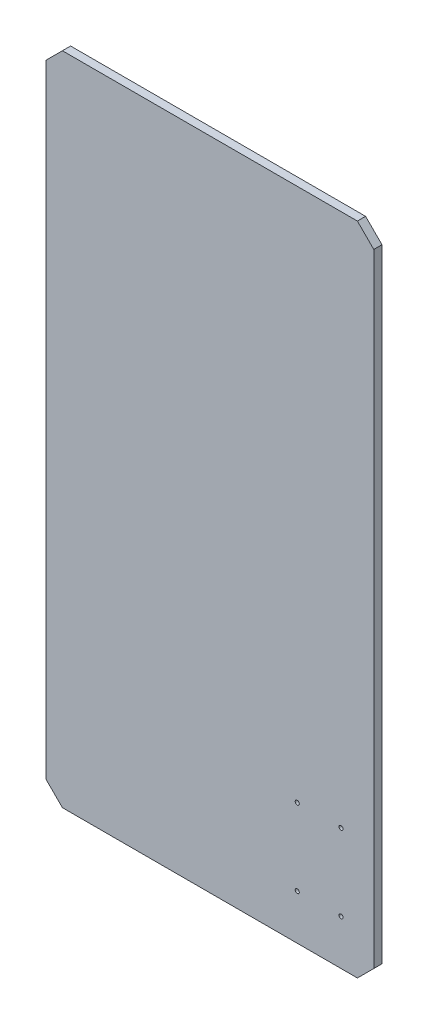
from build123d import *

# Parameters (mm, degrees)
SKETCH_1_W                   = 200
SKETCH_1_H                   = 400
EXTRUDE_1_DEPTH              = 5
CHAMFER_1_SIZE               = 10
CHAMFER_2_SIZE               = 10
HOLE_WIZARD_M3_1_D           = 2.5
HOLE_WIZARD_M3_1_CSINK_D     = 3.05
HOLE_WIZARD_M3_1_CSINK_ANGLE = 90
CUT_EXTRUDE_1_DEPTH          = 2


with BuildPart() as part:
    # ｽｹｯﾁ1 → ﾎﾞｽ - 押し出し1 (new body)
    with BuildSketch(Plane.XY):
        with Locations((100, 200)):
            Rectangle(SKETCH_1_W, SKETCH_1_H)
    extrude(amount=EXTRUDE_1_DEPTH)

    # 面取り1
    chamfer_1_edges = [part.edges().sort_by_distance(p)[0] for p in [
        (0, 0, 2.5),
    ]]
    chamfer(chamfer_1_edges, length=CHAMFER_1_SIZE)

    # 面取り2
    chamfer_2_edges = [part.edges().sort_by_distance(p)[0] for p in [
        (0, 400, 2.5),
        (200, 400, 2.5),
        (200, 0, 2.5),
    ]]
    chamfer(chamfer_2_edges, length=CHAMFER_2_SIZE)

    # M3 ねじ穴1 (through all)
    with Locations(Plane(origin=(0, 0, 0), x_dir=(-1, 0, 0), z_dir=(0, 0, -1))):
        with Locations((-180, 74.287196421), (-153.3, 74.287196421), (-180, 27.547196421), (-153.3, 27.547196421)):
            CounterSinkHole(HOLE_WIZARD_M3_1_D / 2, HOLE_WIZARD_M3_1_CSINK_D / 2, counter_sink_angle=HOLE_WIZARD_M3_1_CSINK_ANGLE)

    # ｽｹｯﾁ5 → ｶｯﾄ - 押し出し1 (cut)
    # profile 1 of 13: a face of its own
    with BuildSketch(Plane(origin=(0, 0, 0), x_dir=(-1, 0, 0), z_dir=(0, 0, -1))):
        with BuildLine():
            Line((-129.993422253, 21.775251777), (-133.447138804, 21.775251777))
            add(Edge.make_bspline(
                [(-133.447138804, 21.775251777), (-133.519828106, 21.778986636), (-133.660415659, 21.786210183), (-133.786060744, 21.849394377), (-133.846742372, 21.879909855)],
                knots=[0, 0, 0, 0, 1.034078768, 2, 2, 2, 2], degree=3))
            add(Edge.make_bspline(
                [(-133.846742372, 21.879909855), (-133.911343823, 21.927105936), (-134.040188087, 22.021236085), (-134.17307878, 22.230955832), (-134.253466745, 22.482233341), (-134.261233053, 22.664935874), (-134.265374681, 22.762367734)],
                knots=[0, 0, 0, 0, 0.932708437, 1.860238878, 2.858905231, 4, 4, 4, 4], degree=3))
            add(Edge.make_bspline(
                [(-134.265374681, 22.762367734), (-134.262465904, 22.845308567), (-134.256925422, 23.003289826), (-134.194780354, 23.224433268), (-134.098277172, 23.420271748), (-134.000287922, 23.522476979), (-133.951400449, 23.573467833)],
                knots=[0, 0, 0, 0, 1.108762057, 2.111910614, 3.058019947, 4, 4, 4, 4], degree=3))
            add(Edge.make_bspline(
                [(-133.951400449, 23.573467833), (-133.916683902, 23.602563821), (-133.847648319, 23.660422644), (-133.726053829, 23.723741481), (-133.590309713, 23.759660645), (-133.495717112, 23.763937465), (-133.447138804, 23.766133839)],
                knots=[0, 0, 0, 0, 0.980612639, 1.949997098, 2.94721499, 4, 4, 4, 4], degree=3))
            Line((-133.447138804, 23.766133839), (-124.270528298, 23.766133839))
            add(Edge.make_bspline(
                [(-124.270528298, 23.766133839), (-124.229196866, 23.763968469), (-124.148232807, 23.75972673), (-124.02987279, 23.7362523), (-123.919357282, 23.693696062), (-123.853652961, 23.651527164), (-123.820974284, 23.630554057)],
                knots=[0, 0, 0, 0, 1.040796309, 2.038813764, 3.024585143, 4, 4, 4, 4], degree=3))
            add(Edge.make_bspline(
                [(-123.820974284, 23.630554057), (-123.763772455, 23.580245083), (-123.649636192, 23.479862309), (-123.534585985, 23.273994923), (-123.464139135, 23.03500249), (-123.456387282, 22.862830647), (-123.452292421, 22.771882104)],
                knots=[0, 0, 0, 0, 0.937933656, 1.871482855, 2.875626068, 4, 4, 4, 4], degree=3))
            add(Edge.make_bspline(
                [(-123.452292421, 22.771882104), (-123.456321111, 22.685084813), (-123.463932665, 22.521095433), (-123.522881973, 22.290440141), (-123.627951655, 22.093677814), (-123.730215076, 21.993452199), (-123.780538209, 21.944131857)],
                knots=[0, 0, 0, 0, 1.132206197, 2.139119666, 3.084273459, 4, 4, 4, 4], degree=3))
            add(Edge.make_bspline(
                [(-123.780538209, 21.944131857), (-123.814486136, 21.917993158), (-123.882311605, 21.865769954), (-124.002383715, 21.814826048), (-124.132042692, 21.778826068), (-124.223477932, 21.77646614), (-124.270528298, 21.775251777)],
                knots=[0, 0, 0, 0, 0.967806876, 1.93360724, 2.936684188, 4, 4, 4, 4], degree=3))
            Line((-124.270528298, 21.775251777), (-127.721866257, 21.775251777))
            Line((-127.721866257, 21.775251777), (-127.721866257, 12.520147714))
            add(Edge.make_bspline(
                [(-127.721866257, 12.520147714), (-127.725634007, 12.454782066), (-127.732888433, 12.328927081), (-127.785934468, 12.148697782), (-127.881180234, 11.990651752), (-127.968047046, 11.904780634), (-128.012054562, 11.861277546)],
                knots=[0, 0, 0, 0, 1.055367196, 2.032003436, 3.002995063, 4, 4, 4, 4], degree=3))
            add(Edge.make_bspline(
                [(-128.012054562, 11.861277546), (-128.068187246, 11.817104272), (-128.181556311, 11.727889177), (-128.388329526, 11.646271054), (-128.615231203, 11.587023961), (-128.776710719, 11.582809183), (-128.861212144, 11.580603611)],
                knots=[0, 0, 0, 0, 0.933565785, 1.885487614, 2.893486225, 4, 4, 4, 4], degree=3))
            add(Edge.make_bspline(
                [(-128.861212144, 11.580603611), (-128.918342053, 11.581984566), (-129.029065506, 11.584660995), (-129.189070046, 11.604864196), (-129.334961855, 11.644705726), (-129.470047228, 11.692511367), (-129.588994155, 11.760602674), (-129.696437871, 11.840018148), (-129.790149168, 11.935307976), (-129.839925058, 12.009477024), (-129.864978249, 12.046807773)],
                knots=[0, 0, 0, 0, 1.182999099, 2.29277005, 3.328038665, 4.309865103, 5.250620735, 6.153517178, 7.070628673, 8, 8, 8, 8], degree=3))
            add(Edge.make_bspline(
                [(-129.864978249, 12.046807773), (-129.885541052, 12.081010493), (-129.926862188, 12.149741164), (-129.961377245, 12.266641402), (-129.991502344, 12.389388354), (-129.992767066, 12.475524865), (-129.993422253, 12.520147714)],
                knots=[0, 0, 0, 0, 0.959372217, 1.927867038, 2.926535604, 4, 4, 4, 4], degree=3))
            Line((-129.993422253, 12.520147714), (-129.993422253, 21.775251777))
        make_face()
    # profile 2 of 13: a face of its own
    with BuildSketch(Plane(origin=(0, 0, 0), x_dir=(-1, 0, 0), z_dir=(0, 0, -1))):
        with BuildLine():
            add(Edge.make_bspline(
                [(-120.333957436, 15.50528151), (-120.328416954, 15.425797272), (-120.31760524, 15.270691474), (-120.274765091, 15.04518223), (-120.219992789, 14.829812119), (-120.13976838, 14.627617417), (-120.044485131, 14.435158116), (-119.930401353, 14.255170297), (-119.798376282, 14.085092447), (-119.696117712, 13.984259582), (-119.644165563, 13.933031758)],
                knots=[0, 0, 0, 0, 1.084653257, 2.116595888, 3.122829659, 4.10784757, 5.074085564, 6.045142731, 7.006840819, 8, 8, 8, 8], degree=3))
            add(Edge.make_bspline(
                [(-119.644165563, 13.933031758), (-119.584926931, 13.88024025), (-119.467843218, 13.775899122), (-119.274525779, 13.641609239), (-119.070559782, 13.527758711), (-118.854811987, 13.433832604), (-118.627222689, 13.363117079), (-118.388678167, 13.310367107), (-118.137778296, 13.278870888), (-117.966555166, 13.275751924), (-117.879249805, 13.274161589)],
                knots=[0, 0, 0, 0, 0.985121924, 1.947069473, 2.91725354, 3.88347878, 4.864850477, 5.873480235, 6.915703881, 8, 8, 8, 8], degree=3))
            add(Edge.make_bspline(
                [(-117.879249805, 13.274161589), (-117.780010379, 13.277054067), (-117.583875275, 13.28277071), (-117.295204968, 13.323665839), (-117.017557818, 13.392439905), (-116.752550622, 13.491060093), (-116.49787825, 13.61544465), (-116.255533619, 13.768697988), (-116.021981765, 13.94775466), (-115.87988852, 14.086123852), (-115.807495593, 14.156619468)],
                knots=[0, 0, 0, 0, 1.028214716, 2.032145968, 3.014564461, 3.986794661, 4.956869984, 5.946238467, 6.953660264, 8, 8, 8, 8], degree=3))
            add(Edge.make_bspline(
                [(-115.807495593, 14.156619468), (-115.768515529, 14.194896596), (-115.69264425, 14.269399671), (-115.557372164, 14.348414526), (-115.411838872, 14.396336102), (-115.311526955, 14.402984448), (-115.260419279, 14.406371698)],
                knots=[0, 0, 0, 0, 1.05643508, 2.056258332, 3.009687768, 4, 4, 4, 4], degree=3))
            add(Edge.make_bspline(
                [(-115.260419279, 14.406371698), (-115.202069431, 14.402658894), (-115.085929628, 14.395268911), (-114.916755012, 14.336121287), (-114.754496732, 14.242401128), (-114.660206585, 14.154737198), (-114.611063482, 14.109047615)],
                knots=[0, 0, 0, 0, 0.953481346, 1.897813608, 2.904360998, 4, 4, 4, 4], degree=3))
            add(Edge.make_bspline(
                [(-114.611063482, 14.109047615), (-114.569376011, 14.061352003), (-114.487880055, 13.968110573), (-114.401393695, 13.804243964), (-114.34601922, 13.628178277), (-114.340381796, 13.505302553), (-114.337525325, 13.443041668)],
                knots=[0, 0, 0, 0, 1.026854471, 2.007425353, 2.990366404, 4, 4, 4, 4], degree=3))
            add(Edge.make_bspline(
                [(-114.337525325, 13.443041668), (-114.343615766, 13.369416846), (-114.356083181, 13.218703434), (-114.443046892, 12.996010333), (-114.586792547, 12.780772535), (-114.713334366, 12.652100314), (-114.779943561, 12.584369716)],
                knots=[0, 0, 0, 0, 0.889666219, 1.821187859, 2.853114922, 4, 4, 4, 4], degree=3))
            add(Edge.make_bspline(
                [(-114.779943561, 12.584369716), (-114.878758661, 12.496370619), (-115.0765434, 12.320234801), (-115.408592026, 12.097746564), (-115.763966368, 11.904281007), (-116.151209305, 11.754254755), (-116.563578255, 11.631130024), (-117.005235374, 11.548105533), (-117.47272903, 11.493654842), (-117.793457674, 11.488235721), (-117.957743363, 11.485459904)],
                knots=[0, 0, 0, 0, 0.920275841, 1.841990919, 2.775548084, 3.731935713, 4.727552795, 5.767934962, 6.85667729, 8, 8, 8, 8], degree=3))
            add(Edge.make_bspline(
                [(-117.957743363, 11.485459904), (-118.101403172, 11.487661143), (-118.383999876, 11.491991253), (-118.798111575, 11.54212805), (-119.195332995, 11.617012621), (-119.574488378, 11.723846877), (-119.93465603, 11.862662216), (-120.277937006, 12.02957767), (-120.602475842, 12.229731886), (-120.803839287, 12.385131295), (-120.904819676, 12.46306149)],
                knots=[0, 0, 0, 0, 1.087547625, 2.139341382, 3.154566458, 4.146905932, 5.118291381, 6.074409701, 7.034348784, 8, 8, 8, 8], degree=3))
            add(Edge.make_bspline(
                [(-120.904819676, 12.46306149), (-121.029536231, 12.572147382), (-121.275734894, 12.78749009), (-121.596838028, 13.155323022), (-121.867515068, 13.554833115), (-122.086620589, 13.986252622), (-122.259552931, 14.447244386), (-122.382040515, 14.938719968), (-122.457845079, 15.46169103), (-122.465833366, 15.820575322), (-122.46993365, 16.00478597)],
                knots=[0, 0, 0, 0, 0.990803486, 1.955911091, 2.912735463, 3.871980722, 4.845023413, 5.853207877, 6.898079473, 8, 8, 8, 8], degree=3))
            add(Edge.make_bspline(
                [(-122.46993365, 16.00478597), (-122.467047575, 16.142044541), (-122.461362805, 16.412405982), (-122.420802088, 16.810102807), (-122.351610769, 17.193415923), (-122.254607219, 17.560907783), (-122.130011381, 17.914293125), (-121.977520452, 18.251294283), (-121.79964628, 18.57571361), (-121.658375644, 18.777070425), (-121.587475771, 18.87812591)],
                knots=[0, 0, 0, 0, 1.077172806, 2.12173264, 3.133585067, 4.131274774, 5.101555746, 6.070778582, 7.031776466, 8, 8, 8, 8], degree=3))
            add(Edge.make_bspline(
                [(-121.587475771, 18.87812591), (-121.48345389, 19.010785425), (-121.279343739, 19.271087905), (-120.925301638, 19.611786206), (-120.540209213, 19.899776535), (-120.122709842, 20.133134625), (-119.676693386, 20.320021186), (-119.197676922, 20.445143459), (-118.689203334, 20.527172806), (-118.33944844, 20.536152845), (-118.159923739, 20.540762184)],
                knots=[0, 0, 0, 0, 1.019647048, 2.000735901, 2.964622973, 3.923224426, 4.889546766, 5.883967398, 6.913867611, 8, 8, 8, 8], degree=3))
            add(Edge.make_bspline(
                [(-118.159923739, 20.540762184), (-118.011441323, 20.536596109), (-117.719503226, 20.528404997), (-117.291246842, 20.465324014), (-116.882505371, 20.361414474), (-116.495164277, 20.212580969), (-116.127694893, 20.023486801), (-115.781408762, 19.790418192), (-115.453300846, 19.517070977), (-115.257426944, 19.306150218), (-115.158139795, 19.19923592)],
                knots=[0, 0, 0, 0, 1.049193693, 2.062867902, 3.052397574, 4.024491703, 4.989484361, 5.96715186, 6.969563106, 8, 8, 8, 8], degree=3))
            add(Edge.make_bspline(
                [(-115.158139795, 19.19923592), (-115.078137193, 19.104509431), (-114.920913429, 18.918349797), (-114.713982741, 18.621916325), (-114.544904008, 18.313902429), (-114.398011922, 18.000958417), (-114.290275636, 17.676366053), (-114.210096773, 17.344006753), (-114.165055078, 17.001856343), (-114.157957775, 16.770815605), (-114.15437369, 16.654141768)],
                knots=[0, 0, 0, 0, 1.062703038, 2.088459213, 3.092660281, 4.072077391, 5.047973574, 6.019076035, 6.999648271, 8, 8, 8, 8], degree=3))
            add(Edge.make_bspline(
                [(-114.15437369, 16.654141768), (-114.156500574, 16.557143474), (-114.160413824, 16.378676491), (-114.20311334, 16.133658216), (-114.270642824, 15.929987552), (-114.350669413, 15.8264427), (-114.387475771, 15.778819666)],
                knots=[0, 0, 0, 0, 1.256689886, 2.312181435, 3.223727323, 4, 4, 4, 4], degree=3))
            add(Edge.make_bspline(
                [(-114.387475771, 15.778819666), (-114.434717664, 15.736283198), (-114.533992482, 15.64689643), (-114.731995511, 15.565795523), (-114.964092244, 15.512002084), (-115.132369672, 15.507623244), (-115.222361797, 15.50528151)],
                knots=[0, 0, 0, 0, 0.840444923, 1.766123473, 2.80535793, 4, 4, 4, 4], degree=3))
            Line((-115.222361797, 15.50528151), (-120.333957436, 15.50528151))
        make_face()
        with BuildLine():
            Line((-120.303035731, 17.12034593), (-116.521073392, 17.12034593))
            add(Edge.make_bspline(
                [(-116.521073392, 17.12034593), (-116.48405073, 17.121489326), (-116.418401829, 17.123516805), (-116.333780976, 17.163602358), (-116.278103143, 17.2327605), (-116.275231304, 17.289753438), (-116.273699755, 17.320147714)],
                knots=[0, 0, 0, 0, 1.21498819, 2.154427454, 3.015758019, 4, 4, 4, 4], degree=3))
            add(Edge.make_bspline(
                [(-116.273699755, 17.320147714), (-116.277616398, 17.392864482), (-116.28566463, 17.542288722), (-116.361336426, 17.762751587), (-116.4736023, 17.98633364), (-116.579532033, 18.123386683), (-116.63524584, 18.195469815)],
                knots=[0, 0, 0, 0, 0.901286064, 1.852034813, 2.870276396, 4, 4, 4, 4], degree=3))
            add(Edge.make_bspline(
                [(-116.63524584, 18.195469815), (-116.682433352, 18.249728504), (-116.776113553, 18.357446937), (-116.935807905, 18.497368921), (-117.109465558, 18.616628409), (-117.298616153, 18.710039991), (-117.499197851, 18.788740424), (-117.715643734, 18.838594812), (-117.944651598, 18.874475245), (-118.10268406, 18.876888565), (-118.183709666, 18.87812591)],
                knots=[0, 0, 0, 0, 0.983334106, 1.952188882, 2.897353198, 3.858335193, 4.833853007, 5.839335188, 6.892194841, 8, 8, 8, 8], degree=3))
            add(Edge.make_bspline(
                [(-118.183709666, 18.87812591), (-118.281543915, 18.874601839), (-118.475733039, 18.867606985), (-118.761778149, 18.8070781), (-119.039917979, 18.714137312), (-119.212441179, 18.620694482), (-119.299269626, 18.573666049)],
                knots=[0, 0, 0, 0, 1.002754896, 1.990346897, 2.988570479, 4, 4, 4, 4], degree=3))
            add(Edge.make_bspline(
                [(-119.299269626, 18.573666049), (-119.366739005, 18.531324877), (-119.498749739, 18.448480045), (-119.679203922, 18.304467856), (-119.837903938, 18.144359438), (-119.972238552, 17.966763044), (-120.092246125, 17.778520164), (-120.182764805, 17.571365776), (-120.259479878, 17.352539165), (-120.288363779, 17.198561092), (-120.303035731, 17.12034593)],
                knots=[0, 0, 0, 0, 1.045052258, 2.044751559, 3.023644325, 3.995874103, 4.96346847, 5.946337349, 6.95681539, 8, 8, 8, 8], degree=3))
        make_face(mode=Mode.SUBTRACT)
    # profile 3 of 13: a face of its own
    with BuildSketch(Plane(origin=(0, 0, 0), x_dir=(-1, 0, 0), z_dir=(0, 0, -1))):
        with BuildLine():
            Line((-109.965672005, 14.72034593), (-109.965672005, 12.472575861))
            add(Edge.make_bspline(
                [(-109.965672005, 12.472575861), (-109.968558955, 12.411118281), (-109.974138969, 12.292330606), (-110.02623796, 12.124350002), (-110.110084106, 11.973960891), (-110.191060077, 11.894426111), (-110.232074384, 11.854141768)],
                knots=[0, 0, 0, 0, 1.059323594, 2.047503148, 3.011060892, 4, 4, 4, 4], degree=3))
            add(Edge.make_bspline(
                [(-110.232074384, 11.854141768), (-110.285304088, 11.812163032), (-110.391631375, 11.728309755), (-110.579622741, 11.643579926), (-110.784724554, 11.588551981), (-110.928620156, 11.583305821), (-111.002738407, 11.580603611)],
                knots=[0, 0, 0, 0, 0.970309698, 1.938211011, 2.938006508, 4, 4, 4, 4], degree=3))
            add(Edge.make_bspline(
                [(-111.002738407, 11.580603611), (-111.056767508, 11.581633489), (-111.161430398, 11.583628526), (-111.311222029, 11.608520218), (-111.448898146, 11.644855169), (-111.570655912, 11.701749358), (-111.68363275, 11.767666056), (-111.7804474, 11.854470091), (-111.865371579, 11.955570721), (-111.910044062, 12.031811437), (-111.93276814, 12.0705937)],
                knots=[0, 0, 0, 0, 1.166781159, 2.26023915, 3.275090114, 4.234116214, 5.157234293, 6.092527273, 7.029703396, 8, 8, 8, 8], degree=3))
            add(Edge.make_bspline(
                [(-111.93276814, 12.0705937), (-111.958716937, 12.132391153), (-112.012668263, 12.260877055), (-112.01800574, 12.400241228), (-112.020776068, 12.472575861)],
                knots=[0, 0, 0, 0, 0.961933608, 2, 2, 2, 2], degree=3))
            Line((-112.020776068, 12.472575861), (-112.020776068, 23.076341966))
            add(Edge.make_bspline(
                [(-112.020776068, 23.076341966), (-112.018959648, 23.128191263), (-112.015439957, 23.228660001), (-111.974577333, 23.371595154), (-111.914187184, 23.503789993), (-111.852160514, 23.577063108), (-111.820974284, 23.613903908)],
                knots=[0, 0, 0, 0, 1.056333137, 2.046863945, 3.017987756, 4, 4, 4, 4], degree=3))
            add(Edge.make_bspline(
                [(-111.820974284, 23.613903908), (-111.769390908, 23.665358393), (-111.666023651, 23.768467366), (-111.46660908, 23.868419056), (-111.243962405, 23.933863403), (-111.085729497, 23.940859125), (-111.002738407, 23.944528289)],
                knots=[0, 0, 0, 0, 0.956336498, 1.91639027, 2.907173958, 4, 4, 4, 4], degree=3))
            add(Edge.make_bspline(
                [(-111.002738407, 23.944528289), (-110.950340953, 23.943238045), (-110.84904178, 23.940743637), (-110.70287969, 23.919374707), (-110.569326479, 23.883030086), (-110.445345027, 23.836949287), (-110.33612264, 23.770188033), (-110.233845534, 23.695504946), (-110.148299276, 23.600968848), (-110.101186939, 23.530470312), (-110.07746586, 23.494974275)],
                knots=[0, 0, 0, 0, 1.16542015, 2.253088408, 3.275732833, 4.242058235, 5.182932379, 6.114333558, 7.050566293, 8, 8, 8, 8], degree=3))
            add(Edge.make_bspline(
                [(-110.07746586, 23.494974275), (-110.045156425, 23.430397428), (-109.979212845, 23.298596038), (-109.970245664, 23.151412226), (-109.965672005, 23.076341966)],
                knots=[0, 0, 0, 0, 0.979911456, 2, 2, 2, 2], degree=3))
            Line((-109.965672005, 23.076341966), (-109.965672005, 17.087045633))
            Line((-109.965672005, 17.087045633), (-106.402540191, 20.114994097))
            add(Edge.make_bspline(
                [(-106.402540191, 20.114994097), (-106.342864386, 20.161491665), (-106.228246125, 20.250798719), (-106.039794195, 20.346739243), (-105.848978656, 20.408226834), (-105.719527392, 20.415744893), (-105.655662094, 20.419453958)],
                knots=[0, 0, 0, 0, 1.101229023, 2.115111047, 3.070082505, 4, 4, 4, 4], degree=3))
            add(Edge.make_bspline(
                [(-105.655662094, 20.419453958), (-105.596559796, 20.41654467), (-105.47911423, 20.410763456), (-105.310250367, 20.355053411), (-105.151532437, 20.268304333), (-105.060378691, 20.187515399), (-105.013442074, 20.145915801)],
                knots=[0, 0, 0, 0, 0.988163292, 1.963635951, 2.951441473, 4, 4, 4, 4], degree=3))
            add(Edge.make_bspline(
                [(-105.013442074, 20.145915801), (-104.961330168, 20.088927424), (-104.860662262, 19.978839326), (-104.7490279, 19.790612954), (-104.680773091, 19.590755341), (-104.672623972, 19.453465994), (-104.668546138, 19.384766148)],
                knots=[0, 0, 0, 0, 1.078221386, 2.0828693, 3.040664202, 4, 4, 4, 4], degree=3))
            add(Edge.make_bspline(
                [(-104.668546138, 19.384766148), (-104.672204284, 19.317511887), (-104.67941025, 19.185031694), (-104.751101889, 18.997308981), (-104.862318305, 18.824858415), (-104.966478134, 18.733112133), (-105.020577852, 18.685459904)],
                knots=[0, 0, 0, 0, 0.991861129, 1.953808574, 2.937225802, 4, 4, 4, 4], degree=3))
            Line((-105.020577852, 18.685459904), (-107.549021856, 16.661277546))
            Line((-107.549021856, 16.661277546), (-104.604324136, 13.42639152))
            add(Edge.make_bspline(
                [(-104.604324136, 13.42639152), (-104.558480371, 13.370035626), (-104.469344255, 13.260460299), (-104.374662538, 13.072132416), (-104.318354821, 12.872266648), (-104.310802956, 12.734577952), (-104.307000053, 12.665241867)],
                knots=[0, 0, 0, 0, 1.040979708, 2.02402418, 3.004955142, 4, 4, 4, 4], degree=3))
            add(Edge.make_bspline(
                [(-104.307000053, 12.665241867), (-104.311231412, 12.584584397), (-104.319325643, 12.430293495), (-104.391028509, 12.212389816), (-104.512202692, 12.023247492), (-104.625342762, 11.926881452), (-104.682817694, 11.877927694)],
                knots=[0, 0, 0, 0, 1.066242779, 2.03963206, 3.004136955, 4, 4, 4, 4], degree=3))
            add(Edge.make_bspline(
                [(-104.682817694, 11.877927694), (-104.742658261, 11.836186722), (-104.859678308, 11.754560982), (-105.052480727, 11.66978236), (-105.250449063, 11.613085707), (-105.385701433, 11.607292661), (-105.453481718, 11.604389538)],
                knots=[0, 0, 0, 0, 1.050080098, 2.053463541, 3.024513982, 4, 4, 4, 4], degree=3))
            add(Edge.make_bspline(
                [(-105.453481718, 11.604389538), (-105.528608385, 11.609708977), (-105.677797357, 11.620272492), (-105.892485624, 11.697029163), (-106.088160439, 11.827181985), (-106.19484021, 11.945072448), (-106.250310261, 12.006371698)],
                knots=[0, 0, 0, 0, 0.976055493, 1.938282652, 2.927973284, 4, 4, 4, 4], degree=3))
            Line((-106.250310261, 12.006371698), (-109.042778051, 15.467224027))
            Line((-109.042778051, 15.467224027), (-109.965672005, 14.72034593))
        make_face()
    # profile 4 of 13: a face of its own
    with BuildSketch(Plane(origin=(0, 0, 0), x_dir=(-1, 0, 0), z_dir=(0, 0, -1))):
        with BuildLine():
            Line((-100.046940588, 19.536996079), (-100.046940588, 12.486847417))
            add(Edge.make_bspline(
                [(-100.046940588, 12.486847417), (-100.048856982, 12.43423851), (-100.052599272, 12.331505059), (-100.092558367, 12.185126274), (-100.154084028, 12.049675853), (-100.215628587, 11.973516298), (-100.246742372, 11.935013918)],
                knots=[0, 0, 0, 0, 1.049414531, 2.049272339, 3.013811777, 4, 4, 4, 4], degree=3))
            add(Edge.make_bspline(
                [(-100.246742372, 11.935013918), (-100.300754321, 11.88063287), (-100.408286339, 11.772366014), (-100.61388735, 11.658712221), (-100.849768164, 11.590765245), (-101.017707027, 11.584089873), (-101.105414324, 11.580603611)],
                knots=[0, 0, 0, 0, 0.955502557, 1.902303478, 2.904462678, 4, 4, 4, 4], degree=3))
            add(Edge.make_bspline(
                [(-101.105414324, 11.580603611), (-101.203716605, 11.585432461), (-101.390056744, 11.594585948), (-101.648040027, 11.681089718), (-101.868397354, 11.819881721), (-101.97008575, 11.955093462), (-102.021172501, 12.023021847)],
                knots=[0, 0, 0, 0, 1.108219753, 2.100722586, 3.045831036, 4, 4, 4, 4], degree=3))
            add(Edge.make_bspline(
                [(-102.021172501, 12.023021847), (-102.041681059, 12.057242847), (-102.08250541, 12.125363195), (-102.117660393, 12.240401235), (-102.147501876, 12.360052537), (-102.148898856, 12.443816636), (-102.149616504, 12.486847417)],
                knots=[0, 0, 0, 0, 0.977721419, 1.946252972, 2.944961648, 4, 4, 4, 4], degree=3))
            Line((-102.149616504, 12.486847417), (-102.149616504, 19.536996079))
            add(Edge.make_bspline(
                [(-102.149616504, 19.536996079), (-102.14512004, 19.613137252), (-102.136424027, 19.760391748), (-102.053502529, 19.964450237), (-101.919565168, 20.140490442), (-101.797319624, 20.223693547), (-101.733362788, 20.267224027)],
                knots=[0, 0, 0, 0, 1.032862522, 1.997521779, 2.952336697, 4, 4, 4, 4], degree=3))
            add(Edge.make_bspline(
                [(-101.733362788, 20.267224027), (-101.684808311, 20.293827889), (-101.587381225, 20.347209924), (-101.43088798, 20.40474646), (-101.265961091, 20.435299361), (-101.154686367, 20.44056872), (-101.098278546, 20.443239884)],
                knots=[0, 0, 0, 0, 0.995284093, 1.997089364, 2.984676657, 4, 4, 4, 4], degree=3))
            add(Edge.make_bspline(
                [(-101.098278546, 20.443239884), (-101.031415616, 20.440687103), (-100.900995847, 20.435707766), (-100.711332366, 20.390846027), (-100.533459387, 20.31821934), (-100.427993062, 20.246198454), (-100.375186376, 20.210137803)],
                knots=[0, 0, 0, 0, 1.036640057, 2.022022624, 3.009632394, 4, 4, 4, 4], degree=3))
            add(Edge.make_bspline(
                [(-100.375186376, 20.210137803), (-100.325423947, 20.166203014), (-100.227863627, 20.080067905), (-100.120625901, 19.917227501), (-100.059516338, 19.732253821), (-100.051207977, 19.603253816), (-100.046940588, 19.536996079)],
                knots=[0, 0, 0, 0, 1.023462161, 2.006519786, 2.976097039, 4, 4, 4, 4], degree=3))
        make_face()
    # profile 5 of 13: a face of its own
    with BuildSketch(Plane(origin=(0, 0, 0), x_dir=(-1, 0, 0), z_dir=(0, 0, -1))):
        with BuildLine():
            add(Edge.make_bspline(
                [(-101.091142768, 24.046807773), (-101.032232289, 24.04478801), (-100.914738869, 24.040759712), (-100.742218037, 23.999778841), (-100.572974408, 23.93915836), (-100.46869973, 23.878090427), (-100.415622451, 23.84700599)],
                knots=[0, 0, 0, 0, 0.988876239, 1.972254422, 2.967848952, 4, 4, 4, 4], degree=3))
            add(Edge.make_bspline(
                [(-100.415622451, 23.84700599), (-100.364645678, 23.815099479), (-100.265470984, 23.75302575), (-100.137143845, 23.638805535), (-100.024321141, 23.517541563), (-99.937249742, 23.380201385), (-99.867262923, 23.234140764), (-99.816881423, 23.076625566), (-99.785148771, 22.907950304), (-99.782095285, 22.791054937), (-99.780538209, 22.731446029)],
                knots=[0, 0, 0, 0, 1.068161542, 2.078095329, 3.046995215, 4.00567359, 4.958521547, 5.922169346, 6.940443753, 8, 8, 8, 8], degree=3))
            add(Edge.make_bspline(
                [(-99.780538209, 22.731446029), (-99.784348453, 22.648512981), (-99.791878889, 22.484606953), (-99.861262222, 22.248344749), (-99.974413597, 22.028975018), (-100.080770555, 21.903427408), (-100.134948516, 21.839473779)],
                knots=[0, 0, 0, 0, 1.010376715, 1.996873841, 2.979612688, 4, 4, 4, 4], degree=3))
            add(Edge.make_bspline(
                [(-100.134948516, 21.839473779), (-100.200504668, 21.774296988), (-100.329302563, 21.646244419), (-100.566941758, 21.512765642), (-100.827564118, 21.426583167), (-101.011143136, 21.418074863), (-101.105414324, 21.413705692)],
                knots=[0, 0, 0, 0, 1.01203367, 1.988338299, 2.966974868, 4, 4, 4, 4], degree=3))
            add(Edge.make_bspline(
                [(-101.105414324, 21.413705692), (-101.160315478, 21.415172987), (-101.268650072, 21.418068351), (-101.428592021, 21.452450364), (-101.585823573, 21.499544969), (-101.68406109, 21.550085573), (-101.733362788, 21.575449993)],
                knots=[0, 0, 0, 0, 1.003778978, 1.980723196, 2.986601254, 4, 4, 4, 4], degree=3))
            add(Edge.make_bspline(
                [(-101.733362788, 21.575449993), (-101.787359934, 21.608250859), (-101.892420467, 21.672070461), (-102.032318749, 21.78751836), (-102.148949189, 21.916527023), (-102.246060235, 22.057047681), (-102.323425907, 22.209359028), (-102.374078855, 22.376170009), (-102.409954943, 22.553103354), (-102.412391911, 22.675752596), (-102.41364029, 22.738581807)],
                knots=[0, 0, 0, 0, 1.067426713, 2.076858254, 3.054534988, 3.999200012, 4.958593863, 5.929628443, 6.939416107, 8, 8, 8, 8], degree=3))
            add(Edge.make_bspline(
                [(-102.41364029, 22.738581807), (-102.408729009, 22.83687128), (-102.399218127, 23.027212578), (-102.308269815, 23.296816846), (-102.164356652, 23.540006409), (-102.02708555, 23.669202696), (-101.956950499, 23.735212134)],
                knots=[0, 0, 0, 0, 1.038473659, 2.011043681, 2.983795189, 4, 4, 4, 4], degree=3))
            add(Edge.make_bspline(
                [(-101.956950499, 23.735212134), (-101.893514664, 23.783007225), (-101.767834099, 23.877699981), (-101.553336525, 23.97293134), (-101.327214668, 24.037527732), (-101.170898158, 24.043672571), (-101.091142768, 24.046807773)],
                knots=[0, 0, 0, 0, 1.012634062, 2.006254401, 2.98275647, 4, 4, 4, 4], degree=3))
        make_face()
    # profile 6 of 13: a face of its own
    with BuildSketch(Plane(origin=(0, 0, 0), x_dir=(-1, 0, 0), z_dir=(0, 0, -1))):
        with BuildLine():
            Line((-95.817802828, 20.243438101), (-95.817802828, 22.065440083))
            add(Edge.make_bspline(
                [(-95.817802828, 22.065440083), (-95.815056064, 22.119647071), (-95.809683686, 22.225670211), (-95.767709003, 22.377173053), (-95.701641076, 22.517354305), (-95.635007568, 22.594803858), (-95.601350895, 22.63392373)],
                knots=[0, 0, 0, 0, 1.04284395, 2.039692533, 3.009846086, 4, 4, 4, 4], degree=3))
            add(Edge.make_bspline(
                [(-95.601350895, 22.63392373), (-95.548792604, 22.685792389), (-95.443734079, 22.789472414), (-95.244781678, 22.897726515), (-95.017607407, 22.960219269), (-94.857270148, 22.96775269), (-94.773600647, 22.971683888)],
                knots=[0, 0, 0, 0, 0.957864324, 1.914670572, 2.911803323, 4, 4, 4, 4], degree=3))
            add(Edge.make_bspline(
                [(-94.773600647, 22.971683888), (-94.723572001, 22.970419954), (-94.626986785, 22.967979806), (-94.487223463, 22.94621621), (-94.359065835, 22.910331737), (-94.239389849, 22.863443814), (-94.132991535, 22.797443968), (-94.032975336, 22.721939622), (-93.947752625, 22.627560188), (-93.899113316, 22.557562137), (-93.874492619, 22.522129875)],
                knots=[0, 0, 0, 0, 1.139748004, 2.200395484, 3.21316453, 4.169550079, 5.117877741, 6.057731074, 7.016844288, 8, 8, 8, 8], degree=3))
            add(Edge.make_bspline(
                [(-93.874492619, 22.522129875), (-93.854226137, 22.488637854), (-93.813390393, 22.421153445), (-93.774646917, 22.308644076), (-93.749094798, 22.189500644), (-93.747084001, 22.107607764), (-93.746048615, 22.065440083)],
                knots=[0, 0, 0, 0, 0.973596338, 1.961738152, 2.950473148, 4, 4, 4, 4], degree=3))
            Line((-93.746048615, 22.065440083), (-93.746048615, 20.243438101))
            Line((-93.746048615, 20.243438101), (-92.052490637, 20.243438101))
            add(Edge.make_bspline(
                [(-92.052490637, 20.243438101), (-92.004534199, 20.240882545), (-91.912311208, 20.235968066), (-91.782204647, 20.192567237), (-91.663906311, 20.126855135), (-91.602953297, 20.060610469), (-91.572014919, 20.026986168)],
                knots=[0, 0, 0, 0, 1.054142564, 2.027176796, 2.998639335, 4, 4, 4, 4], degree=3))
            add(Edge.make_bspline(
                [(-91.572014919, 20.026986168), (-91.536581371, 19.982332776), (-91.466380424, 19.893865474), (-91.397408721, 19.734504303), (-91.353565551, 19.560809476), (-91.348597598, 19.438174152), (-91.346048615, 19.375251777)],
                knots=[0, 0, 0, 0, 0.966763469, 1.915351819, 2.9303978, 4, 4, 4, 4], degree=3))
            add(Edge.make_bspline(
                [(-91.346048615, 19.375251777), (-91.350158188, 19.294567659), (-91.357942627, 19.141734112), (-91.428985701, 18.929125373), (-91.548273327, 18.74951023), (-91.660347033, 18.66436265), (-91.717109071, 18.621237902)],
                knots=[0, 0, 0, 0, 1.101041881, 2.085616595, 3.030421061, 4, 4, 4, 4], degree=3))
            add(Edge.make_bspline(
                [(-91.717109071, 18.621237902), (-91.767638957, 18.595289834), (-91.872808808, 18.541283092), (-91.991056308, 18.535983385), (-92.052490637, 18.533229974)],
                knots=[0, 0, 0, 0, 0.960919606, 2, 2, 2, 2], degree=3))
            Line((-92.052490637, 18.533229974), (-93.746048615, 18.533229974))
            Line((-93.746048615, 18.533229974), (-93.746048615, 12.472575861))
            add(Edge.make_bspline(
                [(-93.746048615, 12.472575861), (-93.74822535, 12.420828966), (-93.752467117, 12.319990655), (-93.788856551, 12.174413335), (-93.851357967, 12.041614239), (-93.909564384, 11.964246119), (-93.938714621, 11.925499547)],
                knots=[0, 0, 0, 0, 1.047651749, 2.041541466, 3.019188349, 4, 4, 4, 4], degree=3))
            add(Edge.make_bspline(
                [(-93.938714621, 11.925499547), (-93.992876508, 11.87283118), (-94.10118525, 11.76750906), (-94.305401567, 11.65658965), (-94.538902141, 11.591548201), (-94.704177988, 11.584351519), (-94.790250796, 11.580603611)],
                knots=[0, 0, 0, 0, 0.954184672, 1.90810455, 2.910576972, 4, 4, 4, 4], degree=3))
            add(Edge.make_bspline(
                [(-94.790250796, 11.580603611), (-94.887060949, 11.584311318), (-95.070550141, 11.591338723), (-95.322200885, 11.679612148), (-95.539892634, 11.813102415), (-95.639159097, 11.946199416), (-95.689358824, 12.013507476)],
                knots=[0, 0, 0, 0, 1.109823067, 2.103503936, 3.040929023, 4, 4, 4, 4], degree=3))
            add(Edge.make_bspline(
                [(-95.689358824, 12.013507476), (-95.709967603, 12.046078612), (-95.751728449, 12.112079523), (-95.78567126, 12.226225153), (-95.815735553, 12.345755213), (-95.81710125, 12.429536335), (-95.817802828, 12.472575861)],
                knots=[0, 0, 0, 0, 0.951760763, 1.928611772, 2.935899118, 4, 4, 4, 4], degree=3))
            Line((-95.817802828, 12.472575861), (-95.817802828, 18.533229974))
            Line((-95.817802828, 18.533229974), (-97.511360806, 18.533229974))
            add(Edge.make_bspline(
                [(-97.511360806, 18.533229974), (-97.550398283, 18.53498557), (-97.62718408, 18.538438787), (-97.737690897, 18.567892588), (-97.840501112, 18.615941178), (-97.899850285, 18.662044503), (-97.929993115, 18.685459904)],
                knots=[0, 0, 0, 0, 1.028344134, 2.022728688, 2.995764396, 4, 4, 4, 4], degree=3))
            add(Edge.make_bspline(
                [(-97.929993115, 18.685459904), (-97.974468931, 18.729499609), (-98.063535692, 18.81769302), (-98.15411163, 18.987475844), (-98.207435662, 19.181741134), (-98.21422511, 19.319375257), (-98.217802828, 19.391901926)],
                knots=[0, 0, 0, 0, 0.950336561, 1.903133147, 2.895050398, 4, 4, 4, 4], degree=3))
            add(Edge.make_bspline(
                [(-98.217802828, 19.391901926), (-98.213647981, 19.474162014), (-98.205773068, 19.630074156), (-98.136015566, 19.844896531), (-98.019102104, 20.025510653), (-97.906163019, 20.105510395), (-97.849120964, 20.145915801)],
                knots=[0, 0, 0, 0, 1.120866365, 2.124440657, 3.052712714, 4, 4, 4, 4], degree=3))
            add(Edge.make_bspline(
                [(-97.849120964, 20.145915801), (-97.796407811, 20.174657208), (-97.691023993, 20.232116854), (-97.571232435, 20.239665366), (-97.511360806, 20.243438101)],
                knots=[0, 0, 0, 0, 1.00040319, 2, 2, 2, 2], degree=3))
            Line((-97.511360806, 20.243438101), (-95.817802828, 20.243438101))
        make_face()
    # profile 7 of 13: a face of its own
    with BuildSketch(Plane(origin=(0, 0, 0), x_dir=(-1, 0, 0), z_dir=(0, 0, -1))):
        with BuildLine():
            add(Edge.make_bspline(
                [(-86.262996088, 20.540762184), (-86.114519835, 20.537350125), (-85.823564695, 20.530663829), (-85.398598515, 20.471085661), (-84.992873916, 20.38036042), (-84.60889161, 20.244876167), (-84.242563815, 20.076881724), (-83.898350363, 19.867140207), (-83.571865068, 19.622929638), (-83.376512867, 19.431490317), (-83.277862292, 19.334815702)],
                knots=[0, 0, 0, 0, 1.075511166, 2.107579469, 3.104199502, 4.083693199, 5.052902101, 6.019637983, 6.999940371, 8, 8, 8, 8], degree=3))
            add(Edge.make_bspline(
                [(-83.277862292, 19.334815702), (-83.179489577, 19.227416623), (-82.983854311, 19.013830495), (-82.734287012, 18.658321207), (-82.52139071, 18.280764137), (-82.345897669, 17.878733788), (-82.214203904, 17.449688581), (-82.116261899, 16.997946918), (-82.058535277, 16.520849994), (-82.051652606, 16.195231491), (-82.048129884, 16.028571896)],
                knots=[0, 0, 0, 0, 0.964678718, 1.918470756, 2.871625348, 3.834412088, 4.820223454, 5.841871117, 6.89541632, 8, 8, 8, 8], degree=3))
            add(Edge.make_bspline(
                [(-82.048129884, 16.028571896), (-82.050325015, 15.896083248), (-82.054631542, 15.636159872), (-82.091213999, 15.25310627), (-82.151083787, 14.884713), (-82.229941612, 14.529229615), (-82.338729831, 14.189424849), (-82.469339577, 13.864478858), (-82.621076274, 13.55118214), (-82.743251231, 13.355597664), (-82.804522352, 13.25751144)],
                knots=[0, 0, 0, 0, 1.091215887, 2.140806187, 3.166241112, 4.164419526, 5.137320209, 6.101522406, 7.047907574, 8, 8, 8, 8], degree=3))
            add(Edge.make_bspline(
                [(-82.804522352, 13.25751144), (-82.90396042, 13.11585928), (-83.09888841, 12.8381792), (-83.449263295, 12.476837776), (-83.832297547, 12.169002048), (-84.252011995, 11.91673519), (-84.708829612, 11.723441097), (-85.201120161, 11.585783037), (-85.728879418, 11.501345183), (-86.093003014, 11.490843089), (-86.279646237, 11.485459904)],
                knots=[0, 0, 0, 0, 1.016929191, 1.993481629, 2.949291603, 3.901292054, 4.864777518, 5.85859117, 6.902352251, 8, 8, 8, 8], degree=3))
            add(Edge.make_bspline(
                [(-86.279646237, 11.485459904), (-86.443996209, 11.489224326), (-86.765394112, 11.496585916), (-87.233602936, 11.564205116), (-87.67504245, 11.676752799), (-88.090451301, 11.830849255), (-88.47981019, 12.029683597), (-88.840997781, 12.274648648), (-89.177081161, 12.563164307), (-89.374285326, 12.785708002), (-89.474096187, 12.898343948)],
                knots=[0, 0, 0, 0, 1.090671838, 2.132885324, 3.132555241, 4.110309006, 5.068482241, 6.027695995, 7.001758609, 8, 8, 8, 8], degree=3))
            add(Edge.make_bspline(
                [(-89.474096187, 12.898343948), (-89.556403636, 13.002200515), (-89.721464424, 13.21047628), (-89.929020877, 13.552221442), (-90.106796471, 13.91434105), (-90.251646428, 14.297449123), (-90.363116755, 14.702151916), (-90.44437936, 15.127554863), (-90.491779742, 15.574769151), (-90.498318753, 15.880194382), (-90.501648219, 16.035707674)],
                knots=[0, 0, 0, 0, 0.942817563, 1.890742727, 2.840078995, 3.812058613, 4.80235947, 5.825428601, 6.892774001, 8, 8, 8, 8], degree=3))
            add(Edge.make_bspline(
                [(-90.501648219, 16.035707674), (-90.498188254, 16.202381698), (-90.491428196, 16.528028392), (-90.432938304, 17.003987748), (-90.338474774, 17.455555977), (-90.20587911, 17.88221067), (-90.033845208, 18.283886921), (-89.819697884, 18.657503406), (-89.573924153, 19.01133462), (-89.379162232, 19.221978343), (-89.281430181, 19.327679924)],
                knots=[0, 0, 0, 0, 1.109635037, 2.167998195, 3.188050864, 4.178370431, 5.138616983, 6.091533468, 7.042326418, 8, 8, 8, 8], degree=3))
            add(Edge.make_bspline(
                [(-89.281430181, 19.327679924), (-89.182102331, 19.425284997), (-88.985741443, 19.61824013), (-88.655124589, 19.862986973), (-88.307579893, 20.07345886), (-87.938999406, 20.246782298), (-87.548013172, 20.376662568), (-87.138063235, 20.471865256), (-86.707098328, 20.530413859), (-86.413033178, 20.537266069), (-86.262996088, 20.540762184)],
                knots=[0, 0, 0, 0, 0.997813793, 1.972574673, 2.942045585, 3.908843932, 4.887181685, 5.891457233, 6.924185264, 8, 8, 8, 8], degree=3))
        make_face()
        with BuildLine():
            add(Edge.make_bspline(
                [(-86.286782015, 18.79725376), (-86.369401771, 18.794399685), (-86.531687819, 18.788793562), (-86.768469444, 18.748002998), (-86.99200368, 18.679188313), (-87.200533293, 18.579543453), (-87.397678647, 18.455909584), (-87.578404498, 18.301483234), (-87.747652537, 18.122243603), (-87.843286159, 17.985120006), (-87.892332064, 17.91479588)],
                knots=[0, 0, 0, 0, 1.034915247, 2.032834671, 3.000628836, 3.956106984, 4.920734575, 5.907814834, 6.927018425, 8, 8, 8, 8], degree=3))
            add(Edge.make_bspline(
                [(-87.892332064, 17.91479588), (-87.93162976, 17.852054029), (-88.011241409, 17.724947793), (-88.108581723, 17.519851286), (-88.197377218, 17.305141963), (-88.260774384, 17.075103506), (-88.317589626, 16.835199614), (-88.353799218, 16.582046996), (-88.379173309, 16.317695372), (-88.381258517, 16.137259829), (-88.382322154, 16.045222045)],
                knots=[0, 0, 0, 0, 0.905547194, 1.834512265, 2.77536825, 3.745993641, 4.751422876, 5.791940539, 6.873698074, 8, 8, 8, 8], degree=3))
            add(Edge.make_bspline(
                [(-88.382322154, 16.045222045), (-88.379583975, 15.906269094), (-88.374258816, 15.636035924), (-88.319954749, 15.245210821), (-88.237440479, 14.879767925), (-88.151047771, 14.652924496), (-88.108783997, 14.54195148)],
                knots=[0, 0, 0, 0, 1.083758657, 2.107674104, 3.074264078, 4, 4, 4, 4], degree=3))
            add(Edge.make_bspline(
                [(-88.108783997, 14.54195148), (-88.062293868, 14.441395582), (-87.972556031, 14.247296984), (-87.798297344, 13.987972576), (-87.603106644, 13.764838395), (-87.379741251, 13.58600118), (-87.134687287, 13.444286786), (-86.865462755, 13.344582141), (-86.571767769, 13.283632301), (-86.36795906, 13.277381036), (-86.262996088, 13.274161589)],
                knots=[0, 0, 0, 0, 1.110800254, 2.144128557, 3.125231192, 4.076354872, 5.003556204, 5.955811976, 6.947228256, 8, 8, 8, 8], degree=3))
            add(Edge.make_bspline(
                [(-86.262996088, 13.274161589), (-86.178763658, 13.276857039), (-86.014837447, 13.282102701), (-85.776259552, 13.324384302), (-85.551503308, 13.389287773), (-85.341444307, 13.486683988), (-85.146867278, 13.610547335), (-84.965756251, 13.760148987), (-84.799880148, 13.937473913), (-84.705743893, 14.072877372), (-84.657446039, 14.142347912)],
                knots=[0, 0, 0, 0, 1.05819591, 2.059373618, 3.036955456, 3.991346983, 4.959124158, 5.929003361, 6.937447718, 8, 8, 8, 8], degree=3))
            add(Edge.make_bspline(
                [(-84.657446039, 14.142347912), (-84.618189901, 14.205904561), (-84.538654749, 14.334673921), (-84.44033513, 14.542568102), (-84.353865564, 14.761466152), (-84.284655587, 14.993826767), (-84.233349313, 15.239080288), (-84.195656276, 15.496440969), (-84.170625316, 15.766433657), (-84.168529224, 15.950813135), (-84.167455949, 16.045222045)],
                knots=[0, 0, 0, 0, 0.899084211, 1.821595382, 2.764973742, 3.731743226, 4.737482727, 5.780038095, 6.863299827, 8, 8, 8, 8], degree=3))
            add(Edge.make_bspline(
                [(-84.167455949, 16.045222045), (-84.168318645, 16.140442438), (-84.170011605, 16.327303575), (-84.198212528, 16.600373967), (-84.23714074, 16.860523771), (-84.294309967, 17.106307492), (-84.368138621, 17.338685852), (-84.459004362, 17.556930635), (-84.562648907, 17.764869853), (-84.648098502, 17.89185417), (-84.690746336, 17.955231956)],
                knots=[0, 0, 0, 0, 1.135282728, 2.227886437, 3.271242152, 4.271484193, 5.234595515, 6.176008337, 7.089647012, 8, 8, 8, 8], degree=3))
            add(Edge.make_bspline(
                [(-84.690746336, 17.955231956), (-84.739941743, 18.02230456), (-84.836271872, 18.153640246), (-85.004603852, 18.325882473), (-85.18612599, 18.471621795), (-85.379518672, 18.592435849), (-85.588296038, 18.683272116), (-85.809123511, 18.750518377), (-86.044485229, 18.788128318), (-86.204991922, 18.794173361), (-86.286782015, 18.79725376)],
                knots=[0, 0, 0, 0, 1.059366011, 2.074357551, 3.059364338, 4.021495031, 4.971819992, 5.953502203, 6.957157224, 8, 8, 8, 8], degree=3))
        make_face(mode=Mode.SUBTRACT)
    # profile 8 of 13: a face of its own
    with BuildSketch(Plane(origin=(0, 0, 0), x_dir=(-1, 0, 0), z_dir=(0, 0, -1))):
        with BuildLine():
            add(Edge.make_bspline(
                [(-74.015622451, 13.064845435), (-74.103695972, 12.941013528), (-74.276058097, 12.698671329), (-74.582821787, 12.384096617), (-74.912378847, 12.112508747), (-75.275153878, 11.896217789), (-75.664730178, 11.724558466), (-76.083281758, 11.605062413), (-76.529363383, 11.528352179), (-76.836305947, 11.520437863), (-76.993620469, 11.516381609)],
                knots=[0, 0, 0, 0, 1.038398247, 2.032171844, 2.99640673, 3.952887524, 4.912486675, 5.901405869, 6.924426357, 8, 8, 8, 8], degree=3))
            add(Edge.make_bspline(
                [(-76.993620469, 11.516381609), (-77.118289592, 11.519241078), (-77.361654601, 11.524823012), (-77.715944463, 11.578202346), (-78.048506084, 11.666257143), (-78.360048719, 11.787906589), (-78.651001827, 11.944041541), (-78.921066409, 12.134751488), (-79.168406533, 12.363135486), (-79.313035462, 12.536674627), (-79.386484691, 12.624805791)],
                knots=[0, 0, 0, 0, 1.092513653, 2.132681988, 3.132627245, 4.103415293, 5.058266925, 6.020755778, 6.994848667, 8, 8, 8, 8], degree=3))
            add(Edge.make_bspline(
                [(-79.386484691, 12.624805791), (-79.440963027, 12.697980787), (-79.551885062, 12.846970644), (-79.680748907, 13.100793874), (-79.800680966, 13.371479347), (-79.890649385, 13.669247901), (-79.966410553, 13.988183983), (-80.012500427, 14.332458824), (-80.049111079, 14.698951946), (-80.05134215, 14.9517561), (-80.052490637, 15.081892015)],
                knots=[0, 0, 0, 0, 0.843233909, 1.716888378, 2.627872477, 3.582200207, 4.591961859, 5.660339916, 6.795613917, 8, 8, 8, 8], degree=3))
            Line((-80.052490637, 15.081892015), (-80.052490637, 19.536996079))
            add(Edge.make_bspline(
                [(-80.052490637, 19.536996079), (-80.050279197, 19.588726653), (-80.0459698, 19.689533158), (-80.01023754, 19.834637966), (-79.946471255, 19.966022703), (-79.888881321, 20.042903838), (-79.859824631, 20.081693799)],
                knots=[0, 0, 0, 0, 1.051464405, 2.048971125, 3.015618941, 4, 4, 4, 4], degree=3))
            add(Edge.make_bspline(
                [(-79.859824631, 20.081693799), (-79.805659367, 20.134349714), (-79.697343869, 20.239646931), (-79.492500013, 20.351125791), (-79.256407487, 20.415754916), (-79.088800023, 20.422869362), (-79.001152679, 20.426589736)],
                knots=[0, 0, 0, 0, 0.947148016, 1.894033191, 2.898722085, 4, 4, 4, 4], degree=3))
            add(Edge.make_bspline(
                [(-79.001152679, 20.426589736), (-78.903743736, 20.422386438), (-78.718569602, 20.41439598), (-78.461980989, 20.332178401), (-78.245131608, 20.193567573), (-78.145274232, 20.060700452), (-78.094908873, 19.993685871)],
                knots=[0, 0, 0, 0, 1.110983429, 2.111976459, 3.047732015, 4, 4, 4, 4], degree=3))
            add(Edge.make_bspline(
                [(-78.094908873, 19.993685871), (-78.074642391, 19.96019385), (-78.033806647, 19.892709441), (-77.99506317, 19.780200073), (-77.969511052, 19.66105664), (-77.967500254, 19.57916376), (-77.966464869, 19.536996079)],
                knots=[0, 0, 0, 0, 0.973596338, 1.961738152, 2.950473148, 4, 4, 4, 4], degree=3))
            Line((-77.966464869, 19.536996079), (-77.966464869, 15.281693799))
            add(Edge.make_bspline(
                [(-77.966464869, 15.281693799), (-77.963839987, 15.1689472), (-77.958793743, 14.952195874), (-77.917473968, 14.642562883), (-77.855058638, 14.360552192), (-77.78412241, 14.190713867), (-77.750012937, 14.109047615)],
                knots=[0, 0, 0, 0, 1.125835395, 2.164378482, 3.11734687, 4, 4, 4, 4], degree=3))
            add(Edge.make_bspline(
                [(-77.750012937, 14.109047615), (-77.719958867, 14.047853822), (-77.661551068, 13.928928336), (-77.54899013, 13.77104083), (-77.420582255, 13.638491434), (-77.280378693, 13.526777944), (-77.122256084, 13.443809452), (-76.951770111, 13.380019337), (-76.764316646, 13.344953099), (-76.63458809, 13.340615146), (-76.567852382, 13.338383591)],
                knots=[0, 0, 0, 0, 1.088659336, 2.11572666, 3.08392595, 4.03225532, 4.968048333, 5.926489907, 6.933333036, 8, 8, 8, 8], degree=3))
            add(Edge.make_bspline(
                [(-76.567852382, 13.338383591), (-76.491561829, 13.341175191), (-76.339360982, 13.346744477), (-76.113316848, 13.390474545), (-75.893536168, 13.466904617), (-75.675244773, 13.565111478), (-75.466099735, 13.700049122), (-75.257247177, 13.855894341), (-75.057322743, 14.046628086), (-74.931923276, 14.188173863), (-74.867158625, 14.261277546)],
                knots=[0, 0, 0, 0, 0.915353744, 1.826145073, 2.750017125, 3.703792534, 4.691341955, 5.730544841, 6.827901958, 8, 8, 8, 8], degree=3))
            add(Edge.make_bspline(
                [(-74.867158625, 14.261277546), (-74.777626766, 14.375239835), (-74.606643644, 14.592878876), (-74.421637195, 14.947598227), (-74.303031853, 15.302701278), (-74.288929572, 15.54248661), (-74.28202483, 15.659890033)],
                knots=[0, 0, 0, 0, 1.122262047, 2.143235604, 3.09089311, 4, 4, 4, 4], degree=3))
            Line((-74.28202483, 15.659890033), (-74.28202483, 19.536996079))
            add(Edge.make_bspline(
                [(-74.28202483, 19.536996079), (-74.279656983, 19.592874642), (-74.275080897, 19.700865249), (-74.22876132, 19.854171714), (-74.161269932, 19.996853017), (-74.091481785, 20.075217591), (-74.056058526, 20.114994097)],
                knots=[0, 0, 0, 0, 1.050697732, 2.0305727, 3.000352691, 4, 4, 4, 4], degree=3))
            add(Edge.make_bspline(
                [(-74.056058526, 20.114994097), (-74.003313771, 20.162956161), (-73.897065869, 20.259569912), (-73.697405963, 20.356082234), (-73.472277052, 20.41788101), (-73.312016678, 20.423601675), (-73.228308279, 20.426589736)],
                knots=[0, 0, 0, 0, 0.937428102, 1.888335039, 2.897019328, 4, 4, 4, 4], degree=3))
            add(Edge.make_bspline(
                [(-73.228308279, 20.426589736), (-73.130899336, 20.422386438), (-72.945725202, 20.41439598), (-72.689136588, 20.332178401), (-72.472287208, 20.193567573), (-72.372429831, 20.060700452), (-72.322064473, 19.993685871)],
                knots=[0, 0, 0, 0, 1.110983429, 2.111976459, 3.047732015, 4, 4, 4, 4], degree=3))
            add(Edge.make_bspline(
                [(-72.322064473, 19.993685871), (-72.301797991, 19.96019385), (-72.260962246, 19.892709441), (-72.22221877, 19.780200073), (-72.196666652, 19.66105664), (-72.194655854, 19.57916376), (-72.193620469, 19.536996079)],
                knots=[0, 0, 0, 0, 0.973596338, 1.961738152, 2.950473148, 4, 4, 4, 4], degree=3))
            Line((-72.193620469, 19.536996079), (-72.193620469, 12.439275563))
            add(Edge.make_bspline(
                [(-72.193620469, 12.439275563), (-72.195324265, 12.387592982), (-72.198628913, 12.287350478), (-72.227555438, 12.143813488), (-72.275113949, 12.01168798), (-72.322309721, 11.933551414), (-72.345850399, 11.894577843)],
                knots=[0, 0, 0, 0, 1.079973315, 2.094694689, 3.049656819, 4, 4, 4, 4], degree=3))
            add(Edge.make_bspline(
                [(-72.345850399, 11.894577843), (-72.385992805, 11.843388244), (-72.465362979, 11.742175393), (-72.63388931, 11.638539178), (-72.829698757, 11.574753786), (-72.970868481, 11.567677328), (-73.045156643, 11.563953462)],
                knots=[0, 0, 0, 0, 0.962314238, 1.902702327, 2.896332829, 4, 4, 4, 4], degree=3))
            add(Edge.make_bspline(
                [(-73.045156643, 11.563953462), (-73.105645917, 11.565764308), (-73.220842462, 11.569212905), (-73.383922928, 11.608115986), (-73.526574656, 11.672313345), (-73.648349151, 11.762907415), (-73.751079692, 11.876887653), (-73.829028822, 12.018984923), (-73.889289972, 12.184198226), (-73.90976277, 12.304794615), (-73.920478744, 12.367917783)],
                knots=[0, 0, 0, 0, 1.096106129, 2.087438486, 3.021213441, 3.916373174, 4.823484222, 5.783829755, 6.840001021, 8, 8, 8, 8], degree=3))
            Line((-73.920478744, 12.367917783), (-74.015622451, 13.064845435))
        make_face()
    # profile 9 of 13: a face of its own
    with BuildSketch(Plane(origin=(0, 0, 0), x_dir=(-1, 0, 0), z_dir=(0, 0, -1))):
        with BuildLine():
            Line((-56.104819676, 15.048591718), (-56.23326368, 23.076341966))
            add(Edge.make_bspline(
                [(-56.23326368, 23.076341966), (-56.230919583, 23.132973059), (-56.226379179, 23.242664817), (-56.179863947, 23.398041085), (-56.10239738, 23.535778773), (-56.029735304, 23.60980536), (-55.993025821, 23.647204206)],
                knots=[0, 0, 0, 0, 1.062021144, 2.057084879, 3.018423183, 4, 4, 4, 4], degree=3))
            add(Edge.make_bspline(
                [(-55.993025821, 23.647204206), (-55.936902988, 23.693478739), (-55.824469532, 23.786182644), (-55.620292945, 23.878799027), (-55.392647245, 23.934336721), (-55.232223644, 23.941036811), (-55.148625424, 23.944528289)],
                knots=[0, 0, 0, 0, 0.949160217, 1.901496409, 2.906450407, 4, 4, 4, 4], degree=3))
            add(Edge.make_bspline(
                [(-55.148625424, 23.944528289), (-55.056075421, 23.941379183), (-54.8791735, 23.935359919), (-54.632762263, 23.863538968), (-54.415217586, 23.752380501), (-54.304788361, 23.63948671), (-54.249517396, 23.582982204)],
                knots=[0, 0, 0, 0, 1.107131356, 2.116192926, 3.05713514, 4, 4, 4, 4], degree=3))
            add(Edge.make_bspline(
                [(-54.249517396, 23.582982204), (-54.220929051, 23.54674854), (-54.164115742, 23.474741773), (-54.108169282, 23.349056921), (-54.073259257, 23.215402758), (-54.06869583, 23.123345878), (-54.066365761, 23.076341966)],
                knots=[0, 0, 0, 0, 1.003412983, 1.994071787, 2.97578027, 4, 4, 4, 4], degree=3))
            Line((-54.066365761, 23.076341966), (-54.066365761, 13.081495583))
            add(Edge.make_bspline(
                [(-54.066365761, 13.081495583), (-54.070331101, 12.978864695), (-54.077971708, 12.781110531), (-54.140777073, 12.497684375), (-54.246113185, 12.241134646), (-54.351981301, 12.094999646), (-54.40412592, 12.023021847)],
                knots=[0, 0, 0, 0, 1.086449205, 2.093422915, 3.060928442, 4, 4, 4, 4], degree=3))
            add(Edge.make_bspline(
                [(-54.40412592, 12.023021847), (-54.466885686, 11.955162728), (-54.591270415, 11.820671499), (-54.833408116, 11.682261275), (-55.107796875, 11.594996054), (-55.303301133, 11.585544837), (-55.405513432, 11.580603611)],
                knots=[0, 0, 0, 0, 0.975076667, 1.9325223, 2.919094382, 4, 4, 4, 4], degree=3))
            add(Edge.make_bspline(
                [(-55.405513432, 11.580603611), (-55.486679964, 11.582716889), (-55.645744075, 11.586858333), (-55.876410072, 11.638131591), (-56.095838739, 11.712240889), (-56.299042701, 11.825125018), (-56.491337277, 11.963369081), (-56.668923602, 12.134792493), (-56.830473465, 12.338570245), (-56.924544016, 12.489807316), (-56.973005999, 12.567719567)],
                knots=[0, 0, 0, 0, 0.99777834, 1.955371533, 2.897352248, 3.841153412, 4.806087631, 5.807538759, 6.870517729, 8, 8, 8, 8], degree=3))
            Line((-56.973005999, 12.567719567), (-62.053679934, 21.335212134))
            Line((-62.053679934, 21.335212134), (-61.92523593, 12.455925712))
            add(Edge.make_bspline(
                [(-61.92523593, 12.455925712), (-61.927990026, 12.39441843), (-61.933279197, 12.276295264), (-61.986329403, 12.11071114), (-62.067036472, 11.961289963), (-62.148040669, 11.883971139), (-62.189259716, 11.844627397)],
                knots=[0, 0, 0, 0, 1.070511493, 2.055890041, 3.010738171, 4, 4, 4, 4], degree=3))
            add(Edge.make_bspline(
                [(-62.189259716, 11.844627397), (-62.244610254, 11.800528506), (-62.355772534, 11.711963275), (-62.558203372, 11.629501416), (-62.778948651, 11.570776474), (-62.935692046, 11.566284093), (-63.017009963, 11.563953462)],
                knots=[0, 0, 0, 0, 0.946242955, 1.900370408, 2.910719615, 4, 4, 4, 4], degree=3))
            add(Edge.make_bspline(
                [(-63.017009963, 11.563953462), (-63.118462418, 11.567818276), (-63.311025904, 11.575153948), (-63.576563159, 11.661321789), (-63.803353399, 11.798453328), (-63.910062113, 11.932080166), (-63.963689844, 11.99923592)],
                knots=[0, 0, 0, 0, 1.117917716, 2.121881941, 3.056129462, 4, 4, 4, 4], degree=3))
            add(Edge.make_bspline(
                [(-63.963689844, 11.99923592), (-63.984310907, 12.031804223), (-64.026096643, 12.097799393), (-64.059626215, 12.211242378), (-64.090308352, 12.329834802), (-64.091510505, 12.4128701), (-64.092133848, 12.455925712)],
                knots=[0, 0, 0, 0, 0.956352849, 1.937917002, 2.930765009, 4, 4, 4, 4], degree=3))
            Line((-64.092133848, 12.455925712), (-64.092133848, 22.338978239))
            add(Edge.make_bspline(
                [(-64.092133848, 22.338978239), (-64.089140187, 22.416032419), (-64.08333073, 22.565562634), (-64.045516304, 22.782865801), (-63.978677068, 22.98396589), (-63.884812511, 23.168522501), (-63.766638269, 23.338536682), (-63.620028158, 23.490852107), (-63.446836615, 23.628050977), (-63.316964537, 23.703506628), (-63.250112045, 23.742347912)],
                knots=[0, 0, 0, 0, 1.070085923, 2.076593121, 3.051528209, 4.001904965, 4.942729954, 5.916233921, 6.927367934, 8, 8, 8, 8], degree=3))
            add(Edge.make_bspline(
                [(-63.250112045, 23.742347912), (-63.183569328, 23.775429084), (-63.050168892, 23.841748027), (-62.833315741, 23.90255501), (-62.608113614, 23.946700251), (-62.453517912, 23.949989178), (-62.374789944, 23.951664067)],
                knots=[0, 0, 0, 0, 0.978924525, 1.962483104, 2.962393097, 4, 4, 4, 4], degree=3))
            add(Edge.make_bspline(
                [(-62.374789944, 23.951664067), (-62.281785998, 23.948731957), (-62.098991756, 23.942969052), (-61.832701995, 23.889567997), (-61.583972188, 23.799982645), (-61.348721703, 23.681185766), (-61.134231141, 23.521225666), (-60.935036105, 23.328204657), (-60.750828344, 23.101602736), (-60.646758197, 22.930999149), (-60.593224037, 22.843239884)],
                knots=[0, 0, 0, 0, 1.009776972, 1.984662218, 2.935653363, 3.875812463, 4.837320693, 5.830459283, 6.883978336, 8, 8, 8, 8], degree=3))
            Line((-60.593224037, 22.843239884), (-56.104819676, 15.048591718))
        make_face()
    # profile 10 of 13: a face of its own
    with BuildSketch(Plane(origin=(0, 0, 0), x_dir=(-1, 0, 0), z_dir=(0, 0, -1))):
        with BuildLine():
            Line((-45.12523593, 19.311029775), (-45.075285484, 19.834320162))
            add(Edge.make_bspline(
                [(-45.075285484, 19.834320162), (-45.068334039, 19.886180646), (-45.055112324, 19.984819796), (-45.0081174, 20.122650392), (-44.931410665, 20.236449281), (-44.834694048, 20.332500507), (-44.711439792, 20.403943531), (-44.567367735, 20.455884263), (-44.399478093, 20.48693119), (-44.280183673, 20.489462723), (-44.216613531, 20.490811738)],
                knots=[0, 0, 0, 0, 1.033929243, 1.966543577, 2.849573842, 3.725752847, 4.640256441, 5.642535887, 6.743744039, 8, 8, 8, 8], degree=3))
            add(Edge.make_bspline(
                [(-44.216613531, 20.490811738), (-44.164958795, 20.48983615), (-44.065799326, 20.487963353), (-43.923080301, 20.462608498), (-43.792578037, 20.425636856), (-43.673639169, 20.373686433), (-43.569406921, 20.30221216), (-43.476570389, 20.217077584), (-43.396762442, 20.115466948), (-43.355298047, 20.039537517), (-43.334155652, 20.000821649)],
                knots=[0, 0, 0, 0, 1.157231213, 2.221489089, 3.240192657, 4.195443921, 5.11784723, 6.061773636, 7.011712373, 8, 8, 8, 8], degree=3))
            add(Edge.make_bspline(
                [(-43.334155652, 20.000821649), (-43.30999593, 19.942929149), (-43.25984516, 19.822755855), (-43.255523327, 19.692506699), (-43.253283502, 19.625004007)],
                knots=[0, 0, 0, 0, 0.963483621, 2, 2, 2, 2], degree=3))
            Line((-43.253283502, 19.625004007), (-43.253283502, 12.455925712))
            add(Edge.make_bspline(
                [(-43.253283502, 12.455925712), (-43.25430693, 12.411386164), (-43.256296712, 12.324790954), (-43.28186008, 12.199581301), (-43.318904837, 12.08154665), (-43.356096643, 12.009098892), (-43.374591727, 11.973071401)],
                knots=[0, 0, 0, 0, 1.060272414, 2.061415476, 3.035962758, 4, 4, 4, 4], degree=3))
            add(Edge.make_bspline(
                [(-43.374591727, 11.973071401), (-43.418144269, 11.912830357), (-43.504781916, 11.792994821), (-43.695226346, 11.667420173), (-43.923095355, 11.590819865), (-44.088269466, 11.584152224), (-44.176177456, 11.580603611)],
                knots=[0, 0, 0, 0, 0.948142206, 1.886108262, 2.874957027, 4, 4, 4, 4], degree=3))
            add(Edge.make_bspline(
                [(-44.176177456, 11.580603611), (-44.2382311, 11.582453869), (-44.356519431, 11.585980882), (-44.523740636, 11.62428812), (-44.669213283, 11.689075399), (-44.79451785, 11.779366571), (-44.898149213, 11.89670006), (-44.982017043, 12.03839318), (-45.041286472, 12.206758711), (-45.063550886, 12.32787082), (-45.075285484, 12.39170371)],
                knots=[0, 0, 0, 0, 1.104709557, 2.105827163, 3.035771258, 3.926321246, 4.837165272, 5.806757241, 6.844037764, 8, 8, 8, 8], degree=3))
            Line((-45.075285484, 12.39170371), (-45.165672005, 12.945915801))
            add(Edge.make_bspline(
                [(-45.165672005, 12.945915801), (-45.234517773, 12.831797461), (-45.369666376, 12.607775933), (-45.626240768, 12.315987254), (-45.915259125, 12.066490839), (-46.240832971, 11.863287058), (-46.603844232, 11.707622338), (-47.000731183, 11.59787667), (-47.432270459, 11.526117973), (-47.731869361, 11.519700085), (-47.886782015, 11.516381609)],
                knots=[0, 0, 0, 0, 0.986073181, 1.935724087, 2.864959096, 3.80732882, 4.76791483, 5.781663608, 6.852971836, 8, 8, 8, 8], degree=3))
            add(Edge.make_bspline(
                [(-47.886782015, 11.516381609), (-48.053566739, 11.521387788), (-48.378645114, 11.531145279), (-48.852050752, 11.607779286), (-49.294551442, 11.739070972), (-49.707652738, 11.921540594), (-50.093116445, 12.153725441), (-50.445285559, 12.442378439), (-50.771397703, 12.779336407), (-50.954469491, 13.037635924), (-51.047931668, 13.169503512)],
                knots=[0, 0, 0, 0, 1.073331571, 2.092019435, 3.077124979, 4.036913944, 4.99192737, 5.964443612, 6.960803662, 8, 8, 8, 8], degree=3))
            add(Edge.make_bspline(
                [(-51.047931668, 13.169503512), (-51.111648686, 13.269117579), (-51.239032506, 13.468267204), (-51.396850563, 13.787301657), (-51.534363572, 14.118777304), (-51.642876161, 14.467862481), (-51.72844702, 14.831963068), (-51.789750853, 15.211869273), (-51.829315265, 15.606720089), (-51.833248462, 15.875452514), (-51.83524584, 16.011921748)],
                knots=[0, 0, 0, 0, 0.947488043, 1.894229336, 2.849300888, 3.822439734, 4.82166305, 5.845892781, 6.906088974, 8, 8, 8, 8], degree=3))
            add(Edge.make_bspline(
                [(-51.83524584, 16.011921748), (-51.833285481, 16.142058427), (-51.829427705, 16.398153369), (-51.78924383, 16.775499961), (-51.728982845, 17.139947368), (-51.640420634, 17.491490971), (-51.525643105, 17.829898594), (-51.387646012, 18.155965577), (-51.226353597, 18.470506782), (-51.098052984, 18.667475371), (-51.033660112, 18.766332055)],
                knots=[0, 0, 0, 0, 1.071830536, 2.10924685, 3.123050515, 4.113281803, 5.092462266, 6.064315476, 7.02849813, 8, 8, 8, 8], degree=3))
            add(Edge.make_bspline(
                [(-51.033660112, 18.766332055), (-50.977826411, 18.845783662), (-50.867621992, 19.002605048), (-50.681753747, 19.219411684), (-50.487313431, 19.422158318), (-50.280582409, 19.608467548), (-50.059644393, 19.775052893), (-49.829073845, 19.927815592), (-49.586060062, 20.064520994), (-49.416049067, 20.140847973), (-49.330587763, 20.179216099)],
                knots=[0, 0, 0, 0, 1.038129847, 2.04905812, 3.05065933, 4.04157649, 5.02194993, 6.00748163, 6.998398789, 8, 8, 8, 8], degree=3))
            add(Edge.make_bspline(
                [(-49.330587763, 20.179216099), (-49.209376109, 20.227096008), (-48.96767417, 20.322570878), (-48.589816959, 20.417557434), (-48.204488083, 20.480868292), (-47.944125381, 20.487482042), (-47.813045642, 20.490811738)],
                knots=[0, 0, 0, 0, 1.001944079, 1.997925261, 2.992054428, 4, 4, 4, 4], degree=3))
            add(Edge.make_bspline(
                [(-47.813045642, 20.490811738), (-47.668576643, 20.487147169), (-47.388065999, 20.480031798), (-46.981267141, 20.425413052), (-46.602698115, 20.332199364), (-46.249847048, 20.204225313), (-45.924769848, 20.036825004), (-45.626771142, 19.833231781), (-45.357259451, 19.591297114), (-45.203082194, 19.405062334), (-45.12523593, 19.311029775)],
                knots=[0, 0, 0, 0, 1.137720309, 2.209073636, 3.225427537, 4.20345146, 5.158698667, 6.097575878, 7.03943932, 8, 8, 8, 8], degree=3))
        make_face()
        with BuildLine():
            Line((-45.294116009, 15.876341966), (-45.294116009, 16.518561986))
            add(Edge.make_bspline(
                [(-45.294116009, 16.518561986), (-45.295744002, 16.591610023), (-45.298962112, 16.736006568), (-45.330666012, 16.948996613), (-45.384216361, 17.154779912), (-45.454159204, 17.354980198), (-45.548696348, 17.546164932), (-45.661660567, 17.73081438), (-45.793703528, 17.910045808), (-45.897820025, 18.018947774), (-45.950607585, 18.074161589)],
                knots=[0, 0, 0, 0, 1.010461383, 1.997413437, 2.971471629, 3.950215785, 4.926804724, 5.916680365, 6.943747032, 8, 8, 8, 8], degree=3))
            add(Edge.make_bspline(
                [(-45.950607585, 18.074161589), (-46.005756142, 18.128583757), (-46.113672674, 18.235078864), (-46.292583115, 18.370381167), (-46.475389515, 18.488423015), (-46.666288398, 18.583315549), (-46.862866707, 18.658551748), (-47.066577198, 18.709682368), (-47.276587646, 18.745713531), (-47.419628737, 18.748349454), (-47.491935632, 18.749681906)],
                knots=[0, 0, 0, 0, 1.073650177, 2.100954386, 3.104735108, 4.088432099, 5.052568069, 6.018208347, 6.998209533, 8, 8, 8, 8], degree=3))
            add(Edge.make_bspline(
                [(-47.491935632, 18.749681906), (-47.574507569, 18.746569287), (-47.736569379, 18.740460228), (-47.973671336, 18.703416151), (-48.196366699, 18.634726106), (-48.408592176, 18.5450275), (-48.606821223, 18.424232647), (-48.793145541, 18.277782305), (-48.968565184, 18.106490516), (-49.069703147, 17.974804485), (-49.121271609, 17.907660102)],
                knots=[0, 0, 0, 0, 1.038415619, 2.038071544, 3.006218394, 3.96170986, 4.927596121, 5.914648316, 6.936715987, 8, 8, 8, 8], degree=3))
            add(Edge.make_bspline(
                [(-49.121271609, 17.907660102), (-49.165233866, 17.844172913), (-49.253454269, 17.71677123), (-49.36584445, 17.510785083), (-49.457480771, 17.291705505), (-49.533951428, 17.060957906), (-49.596393747, 16.81890751), (-49.639055742, 16.562673258), (-49.661755776, 16.294595364), (-49.666127612, 16.111861821), (-49.668347922, 16.019057526)],
                knots=[0, 0, 0, 0, 0.926317059, 1.858868734, 2.809688621, 3.772573131, 4.774172638, 5.806619702, 6.886055017, 8, 8, 8, 8], degree=3))
            add(Edge.make_bspline(
                [(-49.668347922, 16.019057526), (-49.66444826, 15.861692302), (-49.656878276, 15.556216505), (-49.579437296, 15.117078871), (-49.466100264, 14.70847317), (-49.343255134, 14.462679067), (-49.28301591, 14.342149696)],
                knots=[0, 0, 0, 0, 1.085324589, 2.106821224, 3.071647192, 4, 4, 4, 4], degree=3))
            add(Edge.make_bspline(
                [(-49.28301591, 14.342149696), (-49.232824999, 14.257441795), (-49.135166774, 14.092622645), (-48.956034546, 13.874816428), (-48.761591457, 13.686573277), (-48.544750344, 13.535874535), (-48.311848096, 13.417812866), (-48.060383289, 13.333801259), (-47.790499673, 13.283237062), (-47.603950539, 13.277231606), (-47.508585781, 13.274161589)],
                knots=[0, 0, 0, 0, 1.080920049, 2.103184255, 3.089559003, 4.047054918, 4.994221212, 5.95060579, 6.952340437, 8, 8, 8, 8], degree=3))
            add(Edge.make_bspline(
                [(-47.508585781, 13.274161589), (-47.448230391, 13.276113105), (-47.328544307, 13.279983004), (-47.150958395, 13.307342566), (-46.977318144, 13.349954788), (-46.807069445, 13.409293066), (-46.642690435, 13.488725218), (-46.482656443, 13.585219972), (-46.324257258, 13.696164331), (-46.2264641, 13.783710883), (-46.176573888, 13.82837368)],
                knots=[0, 0, 0, 0, 0.979938886, 1.943240678, 2.911349567, 3.88057098, 4.865404105, 5.870153382, 6.91343626, 8, 8, 8, 8], degree=3))
            add(Edge.make_bspline(
                [(-46.176573888, 13.82837368), (-46.105906624, 13.896592519), (-45.966566158, 14.031105222), (-45.789107012, 14.257475181), (-45.634158836, 14.493312177), (-45.511247813, 14.744965045), (-45.411951181, 15.008128801), (-45.343425762, 15.285944151), (-45.302633694, 15.577007705), (-45.296985046, 15.775516322), (-45.294116009, 15.876341966)],
                knots=[0, 0, 0, 0, 1.024449751, 2.019991971, 2.995927319, 3.965945719, 4.937799405, 5.927680382, 6.947436334, 8, 8, 8, 8], degree=3))
        make_face(mode=Mode.SUBTRACT)
    # profile 11 of 13: a face of its own
    with BuildSketch(Plane(origin=(0, 0, 0), x_dir=(-1, 0, 0), z_dir=(0, 0, -1))):
        with BuildLine():
            Line((-33.900657139, 22.105876158), (-35.104225028, 22.105876158))
            add(Edge.make_bspline(
                [(-35.104225028, 22.105876158), (-35.147299642, 22.108124009), (-35.2308514, 22.112484162), (-35.350200094, 22.147621311), (-35.460018784, 22.202370664), (-35.522227863, 22.255132358), (-35.553779042, 22.281892015)],
                knots=[0, 0, 0, 0, 1.044216475, 2.025464969, 2.998556013, 4, 4, 4, 4], degree=3))
            add(Edge.make_bspline(
                [(-35.553779042, 22.281892015), (-35.593244781, 22.323866369), (-35.672726633, 22.408400431), (-35.753150723, 22.567736156), (-35.801683297, 22.747609894), (-35.807590725, 22.874620662), (-35.81066705, 22.940762184)],
                knots=[0, 0, 0, 0, 0.946782966, 1.906769348, 2.909939195, 4, 4, 4, 4], degree=3))
            add(Edge.make_bspline(
                [(-35.81066705, 22.940762184), (-35.80710065, 23.018207388), (-35.800338907, 23.165040198), (-35.734766571, 23.369402706), (-35.623731282, 23.541138797), (-35.518434704, 23.621355668), (-35.465771113, 23.661475762)],
                knots=[0, 0, 0, 0, 1.111423293, 2.107211257, 3.053330554, 4, 4, 4, 4], degree=3))
            add(Edge.make_bspline(
                [(-35.465771113, 23.661475762), (-35.411554629, 23.691991627), (-35.29937647, 23.755131346), (-35.170707427, 23.762385611), (-35.104225028, 23.766133839)],
                knots=[0, 0, 0, 0, 0.966613911, 2, 2, 2, 2], degree=3))
            Line((-35.104225028, 23.766133839), (-30.473105107, 23.766133839))
            add(Edge.make_bspline(
                [(-30.473105107, 23.766133839), (-30.429393247, 23.763376972), (-30.343256844, 23.757944429), (-30.21784877, 23.729149929), (-30.105893384, 23.668385302), (-30.040254334, 23.616488484), (-30.006900945, 23.590117982)],
                knots=[0, 0, 0, 0, 1.030773735, 2.031191136, 2.999582599, 4, 4, 4, 4], degree=3))
            add(Edge.make_bspline(
                [(-30.006900945, 23.590117982), (-29.968257949, 23.548922661), (-29.89038888, 23.46591043), (-29.811138108, 23.307563622), (-29.766969926, 23.126332164), (-29.760514586, 22.998106044), (-29.757148715, 22.931247813)],
                knots=[0, 0, 0, 0, 0.931525586, 1.877106836, 2.893104778, 4, 4, 4, 4], degree=3))
            add(Edge.make_bspline(
                [(-29.757148715, 22.931247813), (-29.760791154, 22.854608695), (-29.767730765, 22.708595123), (-29.833016152, 22.504951781), (-29.944820749, 22.332417722), (-30.050914169, 22.25139746), (-30.104423244, 22.210534235)],
                knots=[0, 0, 0, 0, 1.098764796, 2.093377048, 3.038379277, 4, 4, 4, 4], degree=3))
            add(Edge.make_bspline(
                [(-30.104423244, 22.210534235), (-30.159453923, 22.180021989), (-30.274029713, 22.116494431), (-30.405026167, 22.109507349), (-30.473105107, 22.105876158)],
                knots=[0, 0, 0, 0, 0.960598729, 2, 2, 2, 2], degree=3))
            Line((-30.473105107, 22.105876158), (-31.669537218, 22.105876158))
            Line((-31.669537218, 22.105876158), (-31.669537218, 13.42639152))
            Line((-31.669537218, 13.42639152), (-30.473105107, 13.42639152))
            add(Edge.make_bspline(
                [(-30.473105107, 13.42639152), (-30.429393247, 13.423634653), (-30.343256844, 13.41820211), (-30.21784877, 13.38940761), (-30.105893384, 13.328642983), (-30.040254334, 13.276746165), (-30.006900945, 13.250375662)],
                knots=[0, 0, 0, 0, 1.030773735, 2.031191136, 2.999582599, 4, 4, 4, 4], degree=3))
            add(Edge.make_bspline(
                [(-30.006900945, 13.250375662), (-29.968257949, 13.209180342), (-29.89038888, 13.126168111), (-29.811138108, 12.967821303), (-29.766969926, 12.786589845), (-29.760514586, 12.658363724), (-29.757148715, 12.591505494)],
                knots=[0, 0, 0, 0, 0.931525586, 1.877106836, 2.893104778, 4, 4, 4, 4], degree=3))
            add(Edge.make_bspline(
                [(-29.757148715, 12.591505494), (-29.760791154, 12.514866375), (-29.767730765, 12.368852804), (-29.833016152, 12.165209462), (-29.944820749, 11.992675403), (-30.050914169, 11.911655141), (-30.104423244, 11.870791916)],
                knots=[0, 0, 0, 0, 1.098764796, 2.093377048, 3.038379277, 4, 4, 4, 4], degree=3))
            add(Edge.make_bspline(
                [(-30.104423244, 11.870791916), (-30.159453923, 11.84027967), (-30.274029713, 11.776752112), (-30.405026167, 11.76976503), (-30.473105107, 11.766133839)],
                knots=[0, 0, 0, 0, 0.960598729, 2, 2, 2, 2], degree=3))
            Line((-30.473105107, 11.766133839), (-35.104225028, 11.766133839))
            add(Edge.make_bspline(
                [(-35.104225028, 11.766133839), (-35.147299642, 11.76838169), (-35.2308514, 11.772741843), (-35.350200094, 11.807878992), (-35.460018784, 11.862628345), (-35.522227863, 11.915390039), (-35.553779042, 11.942149696)],
                knots=[0, 0, 0, 0, 1.044216475, 2.025464969, 2.998556013, 4, 4, 4, 4], degree=3))
            add(Edge.make_bspline(
                [(-35.553779042, 11.942149696), (-35.593210719, 11.983316355), (-35.672559653, 12.066156616), (-35.754151989, 12.224439633), (-35.801493981, 12.405599086), (-35.807526519, 12.534114785), (-35.81066705, 12.601019865)],
                knots=[0, 0, 0, 0, 0.935891472, 1.883307906, 2.898053281, 4, 4, 4, 4], degree=3))
            add(Edge.make_bspline(
                [(-35.81066705, 12.601019865), (-35.80710065, 12.678465069), (-35.800338907, 12.825297879), (-35.734766571, 13.029660387), (-35.623731282, 13.201396478), (-35.518434704, 13.281613349), (-35.465771113, 13.321733442)],
                knots=[0, 0, 0, 0, 1.111423293, 2.107211257, 3.053330554, 4, 4, 4, 4], degree=3))
            add(Edge.make_bspline(
                [(-35.465771113, 13.321733442), (-35.411554629, 13.352249308), (-35.29937647, 13.415389027), (-35.170707427, 13.422643292), (-35.104225028, 13.42639152)],
                knots=[0, 0, 0, 0, 0.966613911, 2, 2, 2, 2], degree=3))
            Line((-35.104225028, 13.42639152), (-33.900657139, 13.42639152))
            Line((-33.900657139, 13.42639152), (-33.900657139, 22.105876158))
        make_face()
    # profile 12 of 13: a face of its own
    with BuildSketch(Plane(origin=(0, 0, 0), x_dir=(-1, 0, 0), z_dir=(0, 0, -1))):
        with BuildLine():
            Line((-26.248724532, 20.243438101), (-26.248724532, 22.065440083))
            add(Edge.make_bspline(
                [(-26.248724532, 22.065440083), (-26.245977769, 22.119647071), (-26.240605391, 22.225670211), (-26.198630708, 22.377173053), (-26.132562781, 22.517354305), (-26.065929273, 22.594803858), (-26.0322726, 22.63392373)],
                knots=[0, 0, 0, 0, 1.04284395, 2.039692533, 3.009846086, 4, 4, 4, 4], degree=3))
            add(Edge.make_bspline(
                [(-26.0322726, 22.63392373), (-25.979714309, 22.685792389), (-25.874655784, 22.789472414), (-25.675703383, 22.897726515), (-25.448529112, 22.960219269), (-25.288191853, 22.96775269), (-25.204522352, 22.971683888)],
                knots=[0, 0, 0, 0, 0.957864324, 1.914670572, 2.911803323, 4, 4, 4, 4], degree=3))
            add(Edge.make_bspline(
                [(-25.204522352, 22.971683888), (-25.154493706, 22.970419954), (-25.05790849, 22.967979806), (-24.918145167, 22.94621621), (-24.78998754, 22.910331737), (-24.670311554, 22.863443814), (-24.56391324, 22.797443968), (-24.463897041, 22.721939622), (-24.37867433, 22.627560188), (-24.330035021, 22.557562137), (-24.305414324, 22.522129875)],
                knots=[0, 0, 0, 0, 1.139748004, 2.200395484, 3.21316453, 4.169550079, 5.117877741, 6.057731074, 7.016844288, 8, 8, 8, 8], degree=3))
            add(Edge.make_bspline(
                [(-24.305414324, 22.522129875), (-24.285147842, 22.488637854), (-24.244312097, 22.421153445), (-24.205568621, 22.308644076), (-24.180016503, 22.189500644), (-24.178005705, 22.107607764), (-24.17697032, 22.065440083)],
                knots=[0, 0, 0, 0, 0.973596338, 1.961738152, 2.950473148, 4, 4, 4, 4], degree=3))
            Line((-24.17697032, 22.065440083), (-24.17697032, 20.243438101))
            Line((-24.17697032, 20.243438101), (-22.483412342, 20.243438101))
            add(Edge.make_bspline(
                [(-22.483412342, 20.243438101), (-22.435455903, 20.240882545), (-22.343232913, 20.235968066), (-22.213126352, 20.192567237), (-22.094828015, 20.126855135), (-22.033875002, 20.060610469), (-22.002936623, 20.026986168)],
                knots=[0, 0, 0, 0, 1.054142564, 2.027176796, 2.998639335, 4, 4, 4, 4], degree=3))
            add(Edge.make_bspline(
                [(-22.002936623, 20.026986168), (-21.967503075, 19.982332776), (-21.897302129, 19.893865474), (-21.828330426, 19.734504303), (-21.784487256, 19.560809476), (-21.779519303, 19.438174152), (-21.77697032, 19.375251777)],
                knots=[0, 0, 0, 0, 0.966763469, 1.915351819, 2.9303978, 4, 4, 4, 4], degree=3))
            add(Edge.make_bspline(
                [(-21.77697032, 19.375251777), (-21.781079893, 19.294567659), (-21.788864332, 19.141734112), (-21.859907405, 18.929125373), (-21.979195032, 18.74951023), (-22.091268737, 18.66436265), (-22.148030776, 18.621237902)],
                knots=[0, 0, 0, 0, 1.101041881, 2.085616595, 3.030421061, 4, 4, 4, 4], degree=3))
            add(Edge.make_bspline(
                [(-22.148030776, 18.621237902), (-22.198560662, 18.595289834), (-22.303730513, 18.541283092), (-22.421978013, 18.535983385), (-22.483412342, 18.533229974)],
                knots=[0, 0, 0, 0, 0.960919606, 2, 2, 2, 2], degree=3))
            Line((-22.483412342, 18.533229974), (-24.17697032, 18.533229974))
            Line((-24.17697032, 18.533229974), (-24.17697032, 12.472575861))
            add(Edge.make_bspline(
                [(-24.17697032, 12.472575861), (-24.179147055, 12.420828966), (-24.183388821, 12.319990655), (-24.219778256, 12.174413335), (-24.282279672, 12.041614239), (-24.340486088, 11.964246119), (-24.369636326, 11.925499547)],
                knots=[0, 0, 0, 0, 1.047651749, 2.041541466, 3.019188349, 4, 4, 4, 4], degree=3))
            add(Edge.make_bspline(
                [(-24.369636326, 11.925499547), (-24.423798212, 11.87283118), (-24.532106955, 11.76750906), (-24.736323272, 11.65658965), (-24.969823845, 11.591548201), (-25.135099693, 11.584351519), (-25.221172501, 11.580603611)],
                knots=[0, 0, 0, 0, 0.954184672, 1.90810455, 2.910576972, 4, 4, 4, 4], degree=3))
            add(Edge.make_bspline(
                [(-25.221172501, 11.580603611), (-25.317982653, 11.584311318), (-25.501471845, 11.591338723), (-25.75312259, 11.679612148), (-25.970814338, 11.813102415), (-26.070080802, 11.946199416), (-26.120280528, 12.013507476)],
                knots=[0, 0, 0, 0, 1.109823067, 2.103503936, 3.040929023, 4, 4, 4, 4], degree=3))
            add(Edge.make_bspline(
                [(-26.120280528, 12.013507476), (-26.140889308, 12.046078612), (-26.182650154, 12.112079523), (-26.216592965, 12.226225153), (-26.246657258, 12.345755213), (-26.248022955, 12.429536335), (-26.248724532, 12.472575861)],
                knots=[0, 0, 0, 0, 0.951760763, 1.928611772, 2.935899118, 4, 4, 4, 4], degree=3))
            Line((-26.248724532, 12.472575861), (-26.248724532, 18.533229974))
            Line((-26.248724532, 18.533229974), (-27.94228251, 18.533229974))
            add(Edge.make_bspline(
                [(-27.94228251, 18.533229974), (-27.981319987, 18.53498557), (-28.058105785, 18.538438787), (-28.168612602, 18.567892588), (-28.271422817, 18.615941178), (-28.33077199, 18.662044503), (-28.36091482, 18.685459904)],
                knots=[0, 0, 0, 0, 1.028344134, 2.022728688, 2.995764396, 4, 4, 4, 4], degree=3))
            add(Edge.make_bspline(
                [(-28.36091482, 18.685459904), (-28.405390635, 18.729499609), (-28.494457396, 18.81769302), (-28.585033334, 18.987475844), (-28.638357367, 19.181741134), (-28.645146815, 19.319375257), (-28.648724532, 19.391901926)],
                knots=[0, 0, 0, 0, 0.950336561, 1.903133147, 2.895050398, 4, 4, 4, 4], degree=3))
            add(Edge.make_bspline(
                [(-28.648724532, 19.391901926), (-28.644569686, 19.474162014), (-28.636694773, 19.630074156), (-28.566937271, 19.844896531), (-28.450023808, 20.025510653), (-28.337084724, 20.105510395), (-28.280042669, 20.145915801)],
                knots=[0, 0, 0, 0, 1.120866365, 2.124440657, 3.052712714, 4, 4, 4, 4], degree=3))
            add(Edge.make_bspline(
                [(-28.280042669, 20.145915801), (-28.227329515, 20.174657208), (-28.121945697, 20.232116854), (-28.00215414, 20.239665366), (-27.94228251, 20.243438101)],
                knots=[0, 0, 0, 0, 1.00040319, 2, 2, 2, 2], degree=3))
            Line((-27.94228251, 20.243438101), (-26.248724532, 20.243438101))
        make_face()
    # profile 13 of 13: a face of its own
    with BuildSketch(Plane(origin=(0, 0, 0), x_dir=(-1, 0, 0), z_dir=(0, 0, -1))):
        with BuildLine():
            Line((-14.222560013, 19.311029775), (-14.172609567, 19.834320162))
            add(Edge.make_bspline(
                [(-14.172609567, 19.834320162), (-14.165658123, 19.886180646), (-14.152436407, 19.984819796), (-14.105441483, 20.122650392), (-14.028734748, 20.236449281), (-13.932018131, 20.332500507), (-13.808763875, 20.403943531), (-13.664691818, 20.455884263), (-13.496802177, 20.48693119), (-13.377507756, 20.489462723), (-13.313937614, 20.490811738)],
                knots=[0, 0, 0, 0, 1.033929243, 1.966543577, 2.849573842, 3.725752847, 4.640256441, 5.642535887, 6.743744039, 8, 8, 8, 8], degree=3))
            add(Edge.make_bspline(
                [(-13.313937614, 20.490811738), (-13.262282878, 20.48983615), (-13.163123409, 20.487963353), (-13.020404384, 20.462608498), (-12.88990212, 20.425636856), (-12.770963252, 20.373686433), (-12.666731004, 20.30221216), (-12.573894472, 20.217077584), (-12.494086525, 20.115466948), (-12.452622131, 20.039537517), (-12.431479735, 20.000821649)],
                knots=[0, 0, 0, 0, 1.157231213, 2.221489089, 3.240192657, 4.195443921, 5.11784723, 6.061773636, 7.011712373, 8, 8, 8, 8], degree=3))
            add(Edge.make_bspline(
                [(-12.431479735, 20.000821649), (-12.407320013, 19.942929149), (-12.357169243, 19.822755855), (-12.35284741, 19.692506699), (-12.350607585, 19.625004007)],
                knots=[0, 0, 0, 0, 0.963483621, 2, 2, 2, 2], degree=3))
            Line((-12.350607585, 19.625004007), (-12.350607585, 12.455925712))
            add(Edge.make_bspline(
                [(-12.350607585, 12.455925712), (-12.351631013, 12.411386164), (-12.353620795, 12.324790954), (-12.379184163, 12.199581301), (-12.41622892, 12.08154665), (-12.453420726, 12.009098892), (-12.471915811, 11.973071401)],
                knots=[0, 0, 0, 0, 1.060272414, 2.061415476, 3.035962758, 4, 4, 4, 4], degree=3))
            add(Edge.make_bspline(
                [(-12.471915811, 11.973071401), (-12.515468353, 11.912830357), (-12.602105999, 11.792994821), (-12.792550429, 11.667420173), (-13.020419438, 11.590819865), (-13.185593549, 11.584152224), (-13.273501539, 11.580603611)],
                knots=[0, 0, 0, 0, 0.948142206, 1.886108262, 2.874957027, 4, 4, 4, 4], degree=3))
            add(Edge.make_bspline(
                [(-13.273501539, 11.580603611), (-13.335555183, 11.582453869), (-13.453843515, 11.585980882), (-13.621064719, 11.62428812), (-13.766537367, 11.689075399), (-13.891841933, 11.779366571), (-13.995473296, 11.89670006), (-14.079341126, 12.03839318), (-14.138610555, 12.206758711), (-14.160874969, 12.32787082), (-14.172609567, 12.39170371)],
                knots=[0, 0, 0, 0, 1.104709557, 2.105827163, 3.035771258, 3.926321246, 4.837165272, 5.806757241, 6.844037764, 8, 8, 8, 8], degree=3))
            Line((-14.172609567, 12.39170371), (-14.262996088, 12.945915801))
            add(Edge.make_bspline(
                [(-14.262996088, 12.945915801), (-14.331841857, 12.831797461), (-14.466990459, 12.607775933), (-14.723564852, 12.315987254), (-15.012583208, 12.066490839), (-15.338157054, 11.863287058), (-15.701168315, 11.707622338), (-16.098055266, 11.59787667), (-16.529594543, 11.526117973), (-16.829193444, 11.519700085), (-16.984106098, 11.516381609)],
                knots=[0, 0, 0, 0, 0.986073181, 1.935724087, 2.864959096, 3.80732882, 4.76791483, 5.781663608, 6.852971836, 8, 8, 8, 8], degree=3))
            add(Edge.make_bspline(
                [(-16.984106098, 11.516381609), (-17.150890822, 11.521387788), (-17.475969198, 11.531145279), (-17.949374835, 11.607779286), (-18.391875526, 11.739070972), (-18.804976821, 11.921540594), (-19.190440528, 12.153725441), (-19.542609642, 12.442378439), (-19.868721786, 12.779336407), (-20.051793574, 13.037635924), (-20.145255751, 13.169503512)],
                knots=[0, 0, 0, 0, 1.073331571, 2.092019435, 3.077124979, 4.036913944, 4.99192737, 5.964443612, 6.960803662, 8, 8, 8, 8], degree=3))
            add(Edge.make_bspline(
                [(-20.145255751, 13.169503512), (-20.20897277, 13.269117579), (-20.336356589, 13.468267204), (-20.494174646, 13.787301657), (-20.631687655, 14.118777304), (-20.740200244, 14.467862481), (-20.825771103, 14.831963068), (-20.887074936, 15.211869273), (-20.926639348, 15.606720089), (-20.930572545, 15.875452514), (-20.932569924, 16.011921748)],
                knots=[0, 0, 0, 0, 0.947488043, 1.894229336, 2.849300888, 3.822439734, 4.82166305, 5.845892781, 6.906088974, 8, 8, 8, 8], degree=3))
            add(Edge.make_bspline(
                [(-20.932569924, 16.011921748), (-20.930609564, 16.142058427), (-20.926751789, 16.398153369), (-20.886567913, 16.775499961), (-20.826306928, 17.139947368), (-20.737744718, 17.491490971), (-20.622967189, 17.829898594), (-20.484970096, 18.155965577), (-20.323677681, 18.470506782), (-20.195377067, 18.667475371), (-20.130984195, 18.766332055)],
                knots=[0, 0, 0, 0, 1.071830536, 2.10924685, 3.123050515, 4.113281803, 5.092462266, 6.064315476, 7.02849813, 8, 8, 8, 8], degree=3))
            add(Edge.make_bspline(
                [(-20.130984195, 18.766332055), (-20.075150495, 18.845783662), (-19.964946075, 19.002605048), (-19.77907783, 19.219411684), (-19.584637514, 19.422158318), (-19.377906492, 19.608467548), (-19.156968476, 19.775052893), (-18.926397928, 19.927815592), (-18.683384145, 20.064520994), (-18.51337315, 20.140847973), (-18.427911846, 20.179216099)],
                knots=[0, 0, 0, 0, 1.038129847, 2.04905812, 3.05065933, 4.04157649, 5.02194993, 6.00748163, 6.998398789, 8, 8, 8, 8], degree=3))
            add(Edge.make_bspline(
                [(-18.427911846, 20.179216099), (-18.306700192, 20.227096008), (-18.064998253, 20.322570878), (-17.687141043, 20.417557434), (-17.301812167, 20.480868292), (-17.041449464, 20.487482042), (-16.910369725, 20.490811738)],
                knots=[0, 0, 0, 0, 1.001944079, 1.997925261, 2.992054428, 4, 4, 4, 4], degree=3))
            add(Edge.make_bspline(
                [(-16.910369725, 20.490811738), (-16.765900727, 20.487147169), (-16.485390083, 20.480031798), (-16.078591224, 20.425413052), (-15.700022198, 20.332199364), (-15.347171131, 20.204225313), (-15.022093932, 20.036825004), (-14.724095225, 19.833231781), (-14.454583534, 19.591297114), (-14.300406277, 19.405062334), (-14.222560013, 19.311029775)],
                knots=[0, 0, 0, 0, 1.137720309, 2.209073636, 3.225427537, 4.20345146, 5.158698667, 6.097575878, 7.03943932, 8, 8, 8, 8], degree=3))
        make_face()
        with BuildLine():
            Line((-14.391440092, 15.876341966), (-14.391440092, 16.518561986))
            add(Edge.make_bspline(
                [(-14.391440092, 16.518561986), (-14.393068086, 16.591610023), (-14.396286196, 16.736006568), (-14.427990095, 16.948996613), (-14.481540444, 17.154779912), (-14.551483287, 17.354980198), (-14.646020432, 17.546164932), (-14.75898465, 17.73081438), (-14.891027611, 17.910045808), (-14.995144108, 18.018947774), (-15.047931668, 18.074161589)],
                knots=[0, 0, 0, 0, 1.010461383, 1.997413437, 2.971471629, 3.950215785, 4.926804724, 5.916680365, 6.943747032, 8, 8, 8, 8], degree=3))
            add(Edge.make_bspline(
                [(-15.047931668, 18.074161589), (-15.103080225, 18.128583757), (-15.210996757, 18.235078864), (-15.389907199, 18.370381167), (-15.572713598, 18.488423015), (-15.763612481, 18.583315549), (-15.96019079, 18.658551748), (-16.163901281, 18.709682368), (-16.373911729, 18.745713531), (-16.51695282, 18.748349454), (-16.589259716, 18.749681906)],
                knots=[0, 0, 0, 0, 1.073650177, 2.100954386, 3.104735108, 4.088432099, 5.052568069, 6.018208347, 6.998209533, 8, 8, 8, 8], degree=3))
            add(Edge.make_bspline(
                [(-16.589259716, 18.749681906), (-16.671831652, 18.746569287), (-16.833893463, 18.740460228), (-17.070995419, 18.703416151), (-17.293690782, 18.634726106), (-17.50591626, 18.5450275), (-17.704145306, 18.424232647), (-17.890469624, 18.277782305), (-18.065889267, 18.106490516), (-18.16702723, 17.974804485), (-18.218595692, 17.907660102)],
                knots=[0, 0, 0, 0, 1.038415619, 2.038071544, 3.006218394, 3.96170986, 4.927596121, 5.914648316, 6.936715987, 8, 8, 8, 8], degree=3))
            add(Edge.make_bspline(
                [(-18.218595692, 17.907660102), (-18.262557949, 17.844172913), (-18.350778353, 17.71677123), (-18.463168533, 17.510785083), (-18.554804854, 17.291705505), (-18.631275511, 17.060957906), (-18.69371783, 16.81890751), (-18.736379825, 16.562673258), (-18.759079859, 16.294595364), (-18.763451695, 16.111861821), (-18.765672005, 16.019057526)],
                knots=[0, 0, 0, 0, 0.926317059, 1.858868734, 2.809688621, 3.772573131, 4.774172638, 5.806619702, 6.886055017, 8, 8, 8, 8], degree=3))
            add(Edge.make_bspline(
                [(-18.765672005, 16.019057526), (-18.761772344, 15.861692302), (-18.75420236, 15.556216505), (-18.67676138, 15.117078871), (-18.563424347, 14.70847317), (-18.440579218, 14.462679067), (-18.380339993, 14.342149696)],
                knots=[0, 0, 0, 0, 1.085324589, 2.106821224, 3.071647192, 4, 4, 4, 4], degree=3))
            add(Edge.make_bspline(
                [(-18.380339993, 14.342149696), (-18.330149082, 14.257441795), (-18.232490857, 14.092622645), (-18.053358629, 13.874816428), (-17.85891554, 13.686573277), (-17.642074427, 13.535874535), (-17.409172179, 13.417812866), (-17.157707372, 13.333801259), (-16.887823756, 13.283237062), (-16.701274623, 13.277231606), (-16.605909864, 13.274161589)],
                knots=[0, 0, 0, 0, 1.080920049, 2.103184255, 3.089559003, 4.047054918, 4.994221212, 5.95060579, 6.952340437, 8, 8, 8, 8], degree=3))
            add(Edge.make_bspline(
                [(-16.605909864, 13.274161589), (-16.545554475, 13.276113105), (-16.42586839, 13.279983004), (-16.248282478, 13.307342566), (-16.074642228, 13.349954788), (-15.904393529, 13.409293066), (-15.740014519, 13.488725218), (-15.579980526, 13.585219972), (-15.421581341, 13.696164331), (-15.323788183, 13.783710883), (-15.273897971, 13.82837368)],
                knots=[0, 0, 0, 0, 0.979938886, 1.943240678, 2.911349567, 3.88057098, 4.865404105, 5.870153382, 6.91343626, 8, 8, 8, 8], degree=3))
            add(Edge.make_bspline(
                [(-15.273897971, 13.82837368), (-15.203230707, 13.896592519), (-15.063890241, 14.031105222), (-14.886431095, 14.257475181), (-14.731482919, 14.493312177), (-14.608571896, 14.744965045), (-14.509275264, 15.008128801), (-14.440749845, 15.285944151), (-14.399957777, 15.577007705), (-14.394309129, 15.775516322), (-14.391440092, 15.876341966)],
                knots=[0, 0, 0, 0, 1.024449751, 2.019991971, 2.995927319, 3.965945719, 4.937799405, 5.927680382, 6.947436334, 8, 8, 8, 8], degree=3))
        make_face(mode=Mode.SUBTRACT)
    extrude(amount=-CUT_EXTRUDE_1_DEPTH, mode=Mode.SUBTRACT)


solid = part.part
